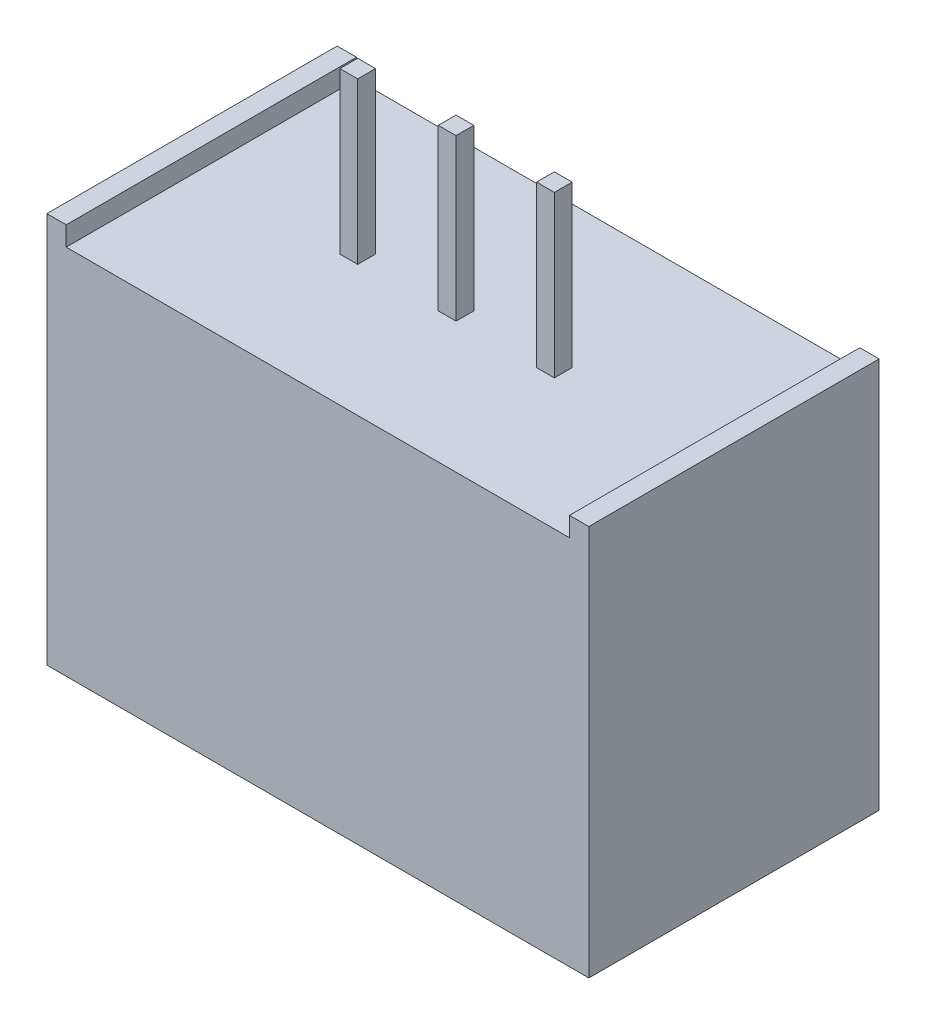
from build123d import *

# Parameters (mm, degrees)
BOTTOM_VIEW_W       = 14
BOTTOM_VIEW_H       = 7.5
BOSS_EXTRUDE1_DEPTH = 10.1
BOTTOM_VIEW_3_W     = 0.46
BOTTOM_VIEW_3_H     = 0.46
BOTTOM_VIEW_3_W_2   = 0.044871794
BOTTOM_VIEW_3_H_2   = 0.365384615
CUT_EXTRUDE1_DEPTH  = 0.5
BOSS_EXTRUDE2_START = -0.5
BOTTOM_VIEW_4_W     = 0.46
BOTTOM_VIEW_4_H     = 0.46
BOSS_EXTRUDE2_DEPTH = 4.15


with BuildPart() as part:
    # Bottom View → Boss-Extrude1 (new body)
    with BuildSketch(Plane(origin=(0, 0, 0), x_dir=(1, 0, 0), z_dir=(0, 1, 0))):
        with Locations((2.58, 0.14)):
            Rectangle(BOTTOM_VIEW_W, BOTTOM_VIEW_H)
    extrude(amount=-BOSS_EXTRUDE1_DEPTH)

    # Bottom View<3> → Cut-Extrude1 (cut)
    # profile 1 of 24: a face of its own
    with BuildSketch(Plane(origin=(0, 0, 0), x_dir=(1, 0, 0), z_dir=(0, 1, 0))):
        with BuildLine():
            Line((9.08, 3.89), (-3.92, 3.89))
            Line((-3.92, 3.89), (-3.92, -3.61))
            Line((-3.92, -3.61), (0.519102564, -3.61))
            Line((0.519102564, -3.61), (0.519102564, -3.11))
            Line((0.519102564, -3.11), (0.616658654, -3.11))
            add(Edge.make_bspline(
                [(0.616658654, -3.11), (0.621434151, -3.110025107), (0.630690252, -3.110073771), (0.644150172, -3.110828504), (0.656757145, -3.1118576), (0.668514827, -3.11349047), (0.679417785, -3.115460724), (0.689498876, -3.117846698), (0.698726043, -3.120707643), (0.709742148, -3.125257111), (0.722302243, -3.132017564), (0.735902013, -3.142007359), (0.74753119, -3.154226282), (0.757557807, -3.168009519), (0.765529395, -3.183171772), (0.771296438, -3.199351656), (0.774947563, -3.216340476), (0.775323054, -3.228003788), (0.775512821, -3.233898237)],
                knots=[0, 0, 0, 0, 1.001505555, 1.941167018, 2.826882275, 3.653841531, 4.429895133, 5.150066043, 5.825578002, 6.45369114, 7.647487171, 8.808567382, 9.977351308, 11.170798116, 12.373658725, 13.556498008, 14.765093433, 16, 16, 16, 16], degree=3))
            add(Edge.make_bspline(
                [(0.775512821, -3.233898237), (0.775356646, -3.239420031), (0.77504975, -3.250270876), (0.77211507, -3.266141463), (0.767520689, -3.28124878), (0.761134224, -3.295537692), (0.752833939, -3.308685351), (0.742997037, -3.320797818), (0.731128922, -3.331362255), (0.722237031, -3.337268384), (0.717720353, -3.340268429)],
                knots=[0, 0, 0, 0, 1.044552857, 2.05264487, 3.044412934, 4.028983338, 5.005914585, 5.980388656, 6.974128949, 8, 8, 8, 8], degree=3))
            add(Edge.make_bspline(
                [(0.717720353, -3.340268429), (0.723400414, -3.342449144), (0.734267778, -3.34662139), (0.749222922, -3.353997885), (0.7621079, -3.362021043), (0.773021778, -3.370782736), (0.782355729, -3.380226852), (0.790506149, -3.390491868), (0.797460631, -3.401711691), (0.80341962, -3.413769339), (0.808069442, -3.426541692), (0.811551714, -3.439908945), (0.813547064, -3.453823167), (0.813831013, -3.463292507), (0.813974359, -3.468072917)],
                knots=[0, 0, 0, 0, 1.27268992, 2.434971085, 3.483601985, 4.442670788, 5.356604649, 6.2567628, 7.179492994, 8.113709626, 9.066344395, 10.018646069, 10.999752585, 12, 12, 12, 12], degree=3))
            add(Edge.make_bspline(
                [(0.813974359, -3.468072917), (0.81383481, -3.472953898), (0.813560242, -3.482557367), (0.811534532, -3.496665243), (0.808104659, -3.510147378), (0.80338021, -3.523090976), (0.797214165, -3.535470995), (0.78971017, -3.547301461), (0.780762804, -3.558463509), (0.770753823, -3.569081169), (0.759430659, -3.578627996), (0.747214123, -3.58713024), (0.733950363, -3.594122534), (0.719857221, -3.599996252), (0.704776604, -3.604482994), (0.688776231, -3.607621933), (0.671869903, -3.609736939), (0.66026851, -3.609910825), (0.65431891, -3.61)],
                knots=[0, 0, 0, 0, 0.978564426, 1.925352924, 2.850884081, 3.763762016, 4.682927383, 5.618979971, 6.567305752, 7.547517671, 8.540179244, 9.531824382, 10.526200242, 11.540722885, 12.589160233, 13.674978461, 14.80764778, 16, 16, 16, 16], degree=3))
            Line((0.65431891, -3.61), (1.027303466, -3.61))
            add(Edge.make_bspline(
                [(1.027303466, -3.61), (1.025496749, -3.6095279), (1.017723578, -3.607365575), (1.004318924, -3.602593724), (0.987583945, -3.594694503), (0.97190016, -3.584892833), (0.957157315, -3.57338424), (0.943575603, -3.560221963), (0.931290088, -3.545934826), (0.920451087, -3.530913392), (0.911323897, -3.515283379), (0.903844154, -3.499014424), (0.898011038, -3.482177462), (0.893935167, -3.46472106), (0.891314651, -3.446718294), (0.891037627, -3.434495017), (0.890897436, -3.428309295)],
                knots=[2.872016618, 2.872016618, 2.872016618, 2.872016618, 3.173186993, 4.173200201, 5.163417411, 6.152872554, 7.150605724, 8.17532212, 9.198891216, 10.186952605, 11.159729845, 12.11414092, 13.071450619, 14.029093627, 15.002601286, 16, 16, 16, 16], degree=3))
            add(Edge.make_bspline(
                [(0.890897436, -3.428309295), (0.891057909, -3.422192645), (0.891375618, -3.410082731), (0.893707119, -3.392236008), (0.897615484, -3.374993524), (0.903148541, -3.358432741), (0.910222139, -3.342467679), (0.918845181, -3.327124132), (0.929100985, -3.312411589), (0.936986978, -3.303308435), (0.940977564, -3.298701923)],
                knots=[0, 0, 0, 0, 1.031353054, 2.041901799, 3.029428768, 4.008703097, 4.981709435, 5.96992636, 6.972712378, 8, 8, 8, 8], degree=3))
            add(Edge.make_bspline(
                [(0.940977564, -3.298701923), (0.945613077, -3.29384836), (0.954729629, -3.284302975), (0.970065162, -3.272084043), (0.986135707, -3.261524604), (1.003239268, -3.253028002), (1.021193962, -3.246336785), (1.040082426, -3.241684569), (1.059836071, -3.238648375), (1.073344588, -3.23835435), (1.080200321, -3.238205128)],
                knots=[0, 0, 0, 0, 1.027980169, 2.021703884, 2.998553061, 3.971491411, 4.943284454, 5.930300938, 6.949603206, 8, 8, 8, 8], degree=3))
            add(Edge.make_bspline(
                [(1.080200321, -3.238205128), (1.087056217, -3.238351113), (1.100498953, -3.238637352), (1.120185794, -3.241696633), (1.138977957, -3.246374828), (1.156947413, -3.252842194), (1.173864026, -3.261511044), (1.189974204, -3.271855229), (1.205233777, -3.284109885), (1.214379924, -3.293589609), (1.219022436, -3.298401442)],
                knots=[0, 0, 0, 0, 1.054011418, 2.066658804, 3.057071809, 4.030435133, 4.997543892, 5.974964718, 6.972108034, 8, 8, 8, 8], degree=3))
            add(Edge.make_bspline(
                [(1.219022436, -3.298401442), (1.223019858, -3.30300344), (1.230937341, -3.312118375), (1.241089586, -3.326897748), (1.249835524, -3.342203477), (1.256844518, -3.358238809), (1.26237095, -3.374863762), (1.266294621, -3.392135478), (1.268628469, -3.410015813), (1.268943178, -3.422159219), (1.269102564, -3.428309295)],
                knots=[0, 0, 0, 0, 1.025258237, 2.030674902, 3.01204498, 3.988269485, 4.97094183, 5.956517959, 6.965070386, 8, 8, 8, 8], degree=3))
            add(Edge.make_bspline(
                [(1.269102564, -3.428309295), (1.268962373, -3.434495017), (1.268685349, -3.446718294), (1.266064832, -3.46472106), (1.261988963, -3.482177463), (1.256155843, -3.49901442), (1.248676113, -3.515283395), (1.239548872, -3.530913331), (1.22871007, -3.545935064), (1.216423785, -3.560221041), (1.202844945, -3.573387643), (1.188114067, -3.58486311), (1.172520633, -3.594694756), (1.155857297, -3.602614244), (1.142475168, -3.607367156), (1.134699566, -3.60952777), (1.13289094, -3.61)],
                knots=[0, 0, 0, 0, 0.998656419, 1.973391657, 2.932242238, 3.890759089, 4.846373663, 5.82037756, 6.809684879, 7.83454468, 8.860553229, 9.859544525, 10.845671541, 11.83227036, 12.833544569, 13.135400297, 13.135400297, 13.135400297, 13.135400297], degree=3))
            Line((1.13289094, -3.61), (1.403717949, -3.61))
            Line((1.403717949, -3.61), (1.403717949, -3.289487179))
            Line((1.403717949, -3.289487179), (1.339615385, -3.289487179))
            Line((1.339615385, -3.289487179), (1.339615385, -3.244615385))
            Line((1.339615385, -3.244615385), (1.403717949, -3.244615385))
            Line((1.403717949, -3.244615385), (1.403717949, -3.097179487))
            Line((1.403717949, -3.097179487), (1.448589744, -3.097179487))
            Line((1.448589744, -3.097179487), (1.448589744, -3.244615385))
            Line((1.448589744, -3.244615385), (1.512692308, -3.244615385))
            Line((1.512692308, -3.244615385), (1.512692308, -3.289487179))
            Line((1.512692308, -3.289487179), (1.448589744, -3.289487179))
            Line((1.448589744, -3.289487179), (1.448589744, -3.61))
            Line((1.448589744, -3.61), (1.634487179, -3.61))
            Line((1.634487179, -3.61), (1.634487179, -3.289487179))
            Line((1.634487179, -3.289487179), (1.570384615, -3.289487179))
            Line((1.570384615, -3.289487179), (1.570384615, -3.244615385))
            Line((1.570384615, -3.244615385), (1.634487179, -3.244615385))
            Line((1.634487179, -3.244615385), (1.634487179, -3.097179487))
            Line((1.634487179, -3.097179487), (1.679358974, -3.097179487))
            Line((1.679358974, -3.097179487), (1.679358974, -3.244615385))
            Line((1.679358974, -3.244615385), (1.743461538, -3.244615385))
            Line((1.743461538, -3.244615385), (1.743461538, -3.289487179))
            Line((1.743461538, -3.289487179), (1.679358974, -3.289487179))
            Line((1.679358974, -3.289487179), (1.679358974, -3.61))
            Line((1.679358974, -3.61), (1.943970133, -3.61))
            add(Edge.make_bspline(
                [(1.943970133, -3.61), (1.942163415, -3.6095279), (1.934390245, -3.607365575), (1.92098559, -3.602593724), (1.904250612, -3.594694503), (1.888566827, -3.584892833), (1.873823982, -3.57338424), (1.86024227, -3.560221963), (1.847956755, -3.545934826), (1.837117753, -3.530913392), (1.827990564, -3.515283379), (1.820510821, -3.499014424), (1.814677704, -3.482177462), (1.810601834, -3.46472106), (1.807981318, -3.446718294), (1.807704294, -3.434495017), (1.807564103, -3.428309295)],
                knots=[2.872016618, 2.872016618, 2.872016618, 2.872016618, 3.173186993, 4.173200201, 5.163417411, 6.152872554, 7.150605724, 8.17532212, 9.198891216, 10.186952605, 11.159729845, 12.11414092, 13.071450619, 14.029093627, 15.002601286, 16, 16, 16, 16], degree=3))
            add(Edge.make_bspline(
                [(1.807564103, -3.428309295), (1.807724575, -3.422192645), (1.808042284, -3.410082731), (1.810373786, -3.392236008), (1.814282151, -3.374993524), (1.819815207, -3.358432741), (1.826888806, -3.342467679), (1.835511847, -3.327124132), (1.845767652, -3.312411589), (1.853653645, -3.303308435), (1.857644231, -3.298701923)],
                knots=[0, 0, 0, 0, 1.031353054, 2.041901799, 3.029428768, 4.008703097, 4.981709435, 5.96992636, 6.972712378, 8, 8, 8, 8], degree=3))
            add(Edge.make_bspline(
                [(1.857644231, -3.298701923), (1.862279744, -3.29384836), (1.871396296, -3.284302975), (1.886731828, -3.272084043), (1.902802374, -3.261524604), (1.919905935, -3.253028002), (1.937860629, -3.246336785), (1.956749092, -3.241684569), (1.976502737, -3.238648375), (1.990011255, -3.23835435), (1.996866987, -3.238205128)],
                knots=[0, 0, 0, 0, 1.027980169, 2.021703884, 2.998553061, 3.971491411, 4.943284454, 5.930300938, 6.949603206, 8, 8, 8, 8], degree=3))
            add(Edge.make_bspline(
                [(1.996866987, -3.238205128), (2.003722883, -3.238351113), (2.01716562, -3.238637352), (2.036852461, -3.241696633), (2.055644623, -3.246374828), (2.073614079, -3.252842194), (2.090530693, -3.261511044), (2.106640871, -3.271855229), (2.121900443, -3.284109885), (2.13104659, -3.293589609), (2.135689103, -3.298401442)],
                knots=[0, 0, 0, 0, 1.054011418, 2.066658804, 3.057071809, 4.030435133, 4.997543892, 5.974964718, 6.972108034, 8, 8, 8, 8], degree=3))
            add(Edge.make_bspline(
                [(2.135689103, -3.298401442), (2.139686525, -3.30300344), (2.147604007, -3.312118375), (2.157756253, -3.326897748), (2.16650219, -3.342203477), (2.173511185, -3.358238809), (2.179037617, -3.374863762), (2.182961287, -3.392135478), (2.185295135, -3.410015813), (2.185609845, -3.422159219), (2.185769231, -3.428309295)],
                knots=[0, 0, 0, 0, 1.025258237, 2.030674902, 3.01204498, 3.988269485, 4.97094183, 5.956517959, 6.965070386, 8, 8, 8, 8], degree=3))
            add(Edge.make_bspline(
                [(2.185769231, -3.428309295), (2.18562904, -3.434495017), (2.185352016, -3.446718294), (2.182731499, -3.46472106), (2.17865563, -3.482177463), (2.17282251, -3.49901442), (2.16534278, -3.515283395), (2.156215539, -3.530913331), (2.145376736, -3.545935064), (2.133090451, -3.560221041), (2.119511612, -3.573387643), (2.104780733, -3.58486311), (2.0891873, -3.594694756), (2.072523964, -3.602614244), (2.059141834, -3.607367156), (2.051366232, -3.60952777), (2.049557607, -3.61)],
                knots=[0, 0, 0, 0, 0.998656419, 1.973391657, 2.932242238, 3.890759089, 4.846373663, 5.82037756, 6.809684879, 7.83454468, 8.860553229, 9.859544525, 10.845671541, 11.83227036, 12.833544569, 13.135400297, 13.135400297, 13.135400297, 13.135400297], degree=3))
            Line((2.049557607, -3.61), (2.275512821, -3.61))
            Line((2.275512821, -3.61), (2.275512821, -3.244615385))
            Line((2.275512821, -3.244615385), (2.320384615, -3.244615385))
            Line((2.320384615, -3.244615385), (2.320384615, -3.308116987))
            add(Edge.make_bspline(
                [(2.320384615, -3.308116987), (2.32442518, -3.302561616), (2.332167288, -3.291916991), (2.344862381, -3.277889807), (2.357544683, -3.265985785), (2.366678023, -3.259736804), (2.371065705, -3.256734776)],
                knots=[0, 0, 0, 0, 1.134379233, 2.173579362, 3.122582517, 4, 4, 4, 4], degree=3))
            add(Edge.make_bspline(
                [(2.371065705, -3.256734776), (2.377046371, -3.253876866), (2.388903214, -3.248210979), (2.407677389, -3.242463327), (2.426888056, -3.23893117), (2.439860658, -3.238448117), (2.446386218, -3.238205128)],
                knots=[0, 0, 0, 0, 1.014936303, 2.012140481, 3.000054389, 4, 4, 4, 4], degree=3))
            add(Edge.make_bspline(
                [(2.446386218, -3.238205128), (2.450799503, -3.238354455), (2.459533157, -3.238649966), (2.472473742, -3.240572828), (2.485024972, -3.243896567), (2.49711269, -3.248526185), (2.508501359, -3.254132855), (2.518942673, -3.260711384), (2.52831756, -3.268096681), (2.536621281, -3.276622243), (2.544088285, -3.286527471), (2.550956692, -3.298079506), (2.55730315, -3.311537744), (2.56082048, -3.321304392), (2.562672276, -3.326446314)],
                knots=[0, 0, 0, 0, 1.009824226, 1.998387844, 2.986035974, 3.974953746, 4.955485308, 5.885931332, 6.793869504, 7.679848016, 8.601185859, 9.625726857, 10.749998409, 12, 12, 12, 12], degree=3))
            add(Edge.make_bspline(
                [(2.562672276, -3.326446314), (2.564631026, -3.322914254), (2.568485571, -3.315963656), (2.574957805, -3.306126762), (2.581738919, -3.296925791), (2.588886704, -3.288353445), (2.59637593, -3.280452055), (2.604241845, -3.273195498), (2.61243967, -3.26655261), (2.623838562, -3.258792159), (2.638668934, -3.250549133), (2.657367236, -3.243402212), (2.676817261, -3.238985622), (2.690019789, -3.238467012), (2.696686699, -3.238205128)],
                knots=[0, 0, 0, 0, 0.86119277, 1.694706429, 2.50939023, 3.298075842, 4.073795165, 4.829715201, 5.57930267, 6.321991688, 7.768977793, 9.186738141, 10.579381044, 12, 12, 12, 12], degree=3))
            add(Edge.make_bspline(
                [(2.696686699, -3.238205128), (2.702812622, -3.23843616), (2.714801649, -3.238888311), (2.732255544, -3.242438807), (2.748532944, -3.248535614), (2.763601098, -3.256854705), (2.777195357, -3.267308874), (2.789011973, -3.279747279), (2.798979168, -3.29408194), (2.805490402, -3.307566509), (2.809906868, -3.319471557), (2.812629902, -3.329615313), (2.815035572, -3.34077982), (2.817032893, -3.352978429), (2.818492686, -3.36625423), (2.819574217, -3.380585498), (2.820306228, -3.395983372), (2.820357952, -3.406607014), (2.820384615, -3.412083333)],
                knots=[0, 0, 0, 0, 1.209669288, 2.367440248, 3.500751976, 4.631527125, 5.755587489, 6.87532382, 8.007944318, 9.190864318, 9.82315674, 10.514484317, 11.263564316, 12.079023757, 12.955305781, 13.901327259, 14.918167583, 16, 16, 16, 16], degree=3))
            Line((2.820384615, -3.412083333), (2.820384615, -3.61))
            Line((2.820384615, -3.61), (3.301153846, -3.61))
            Line((3.301153846, -3.61), (3.089615385, -3.11))
            Line((3.089615385, -3.11), (3.137692308, -3.11))
            Line((3.137692308, -3.11), (3.304358974, -3.504030449))
            Line((3.304358974, -3.504030449), (3.471025641, -3.11))
            Line((3.471025641, -3.11), (3.519102564, -3.11))
            Line((3.519102564, -3.11), (3.307564103, -3.61))
            Line((3.307564103, -3.61), (3.589615385, -3.61))
            Line((3.589615385, -3.61), (3.589615385, -3.244615385))
            Line((3.589615385, -3.244615385), (3.634487179, -3.244615385))
            Line((3.634487179, -3.244615385), (3.634487179, -3.61))
            Line((3.634487179, -3.61), (3.861046912, -3.61))
            add(Edge.make_bspline(
                [(3.861046912, -3.61), (3.859001551, -3.609468253), (3.850980591, -3.607234069), (3.837415866, -3.602393778), (3.821024116, -3.594189875), (3.805809708, -3.584195663), (3.791692633, -3.572462484), (3.779117746, -3.558888706), (3.767797191, -3.544362712), (3.757807789, -3.529226157), (3.749456727, -3.513517125), (3.742663497, -3.497335622), (3.737177088, -3.480783637), (3.733353273, -3.46371057), (3.731149023, -3.44616263), (3.730811245, -3.434291582), (3.730641026, -3.428309295)],
                knots=[2.931969346, 2.931969346, 2.931969346, 2.931969346, 3.276747158, 4.290159414, 5.277019952, 6.260822364, 7.254936242, 8.264827045, 9.274100331, 10.257902744, 11.220704747, 12.172965371, 13.118907548, 14.062713208, 15.023725156, 16, 16, 16, 16], degree=3))
            add(Edge.make_bspline(
                [(3.730641026, -3.428309295), (3.730792332, -3.422695748), (3.7310922, -3.411570438), (3.732982312, -3.395103932), (3.736332069, -3.379099867), (3.740928686, -3.363544946), (3.746864579, -3.348465213), (3.754126324, -3.333851489), (3.762725235, -3.319719327), (3.769364189, -3.310804593), (3.772708333, -3.306314103)],
                knots=[0, 0, 0, 0, 1.024358464, 2.0301432, 3.019427413, 4.004406732, 4.986367066, 5.972626655, 6.978780325, 8, 8, 8, 8], degree=3))
            add(Edge.make_bspline(
                [(3.772708333, -3.306314103), (3.777238002, -3.300904264), (3.786153852, -3.290255957), (3.801233331, -3.276264767), (3.817561931, -3.264544228), (3.83493502, -3.254828923), (3.853554516, -3.247446973), (3.873170129, -3.24194589), (3.894005213, -3.238863317), (3.908248816, -3.238427912), (3.915536859, -3.238205128)],
                knots=[0, 0, 0, 0, 1.030682036, 2.02871468, 2.997146059, 3.962720338, 4.930598197, 5.918074684, 6.934738563, 8, 8, 8, 8], degree=3))
            add(Edge.make_bspline(
                [(3.915536859, -3.238205128), (3.923029374, -3.238398564), (3.937727981, -3.23877804), (3.959161141, -3.242296088), (3.979441243, -3.247875024), (3.998560172, -3.255754137), (4.016519867, -3.265919787), (4.033203588, -3.278511479), (4.048896661, -3.293142634), (4.058026458, -3.304394521), (4.062672276, -3.310120192)],
                knots=[0, 0, 0, 0, 1.056321875, 2.072262726, 3.055038591, 4.01806755, 4.982017516, 5.957941055, 6.960871419, 8, 8, 8, 8], degree=3))
            add(Edge.make_bspline(
                [(4.062672276, -3.310120192), (4.065833267, -3.31443499), (4.072134209, -3.323035864), (4.080026652, -3.337060315), (4.086877708, -3.351733257), (4.092353845, -3.367291871), (4.09678806, -3.383551811), (4.099996177, -3.400629317), (4.101877551, -3.418519304), (4.102247365, -3.430708812), (4.102435897, -3.436923077)],
                knots=[0, 0, 0, 0, 0.94817472, 1.890038105, 2.849395472, 3.817997239, 4.812318967, 5.836947057, 6.897266129, 8, 8, 8, 8], degree=3))
            Line((4.102435897, -3.436923077), (3.775512821, -3.436923077))
            add(Edge.make_bspline(
                [(3.775512821, -3.436923077), (3.775732764, -3.441737429), (3.776165275, -3.451204658), (3.778181724, -3.465057627), (3.78136012, -3.478253819), (3.785827129, -3.490694253), (3.791236678, -3.502541414), (3.797863209, -3.51370742), (3.80576886, -3.52414141), (3.814586817, -3.533936715), (3.824402116, -3.542659681), (3.834728223, -3.550467078), (3.845713018, -3.557010734), (3.857269887, -3.562322147), (3.869380142, -3.566480192), (3.882047599, -3.569318452), (3.89524733, -3.571219468), (3.904245292, -3.571430848), (3.908826122, -3.571538462)],
                knots=[0, 0, 0, 0, 1.094153842, 2.151609401, 3.174256925, 4.172055639, 5.149267565, 6.128595816, 7.11444997, 8.118368179, 9.117203808, 10.09244225, 11.054858984, 12.015122123, 12.976791628, 13.957293641, 14.960065497, 16, 16, 16, 16], degree=3))
            add(Edge.make_bspline(
                [(3.908826122, -3.571538462), (3.913304857, -3.571451596), (3.922191527, -3.571279239), (3.935425935, -3.569603252), (3.948445868, -3.566893212), (3.961197437, -3.563194642), (3.973421844, -3.558683663), (3.984742636, -3.553240398), (3.995154096, -3.547219006), (4.004885091, -3.540331909), (4.014323804, -3.531902168), (4.023687017, -3.52138278), (4.033726539, -3.508941704), (4.040010766, -3.499578038), (4.043341346, -3.494615385)],
                knots=[0, 0, 0, 0, 0.99110716, 1.966546729, 2.947904876, 3.932708344, 4.903319531, 5.828989031, 6.710028674, 7.56322171, 8.463672341, 9.504779593, 10.677557249, 12, 12, 12, 12], degree=3))
            Line((4.043341346, -3.494615385), (4.083205128, -3.515548878))
            add(Edge.make_bspline(
                [(4.083205128, -3.515548878), (4.080028472, -3.52118364), (4.073847956, -3.532146655), (4.063219278, -3.547208349), (4.052077553, -3.560758023), (4.039919844, -3.572433687), (4.027109889, -3.582612457), (4.013576653, -3.59151786), (3.999249679, -3.59910622), (3.984252042, -3.605447117), (3.973861677, -3.608645036), (3.968611116, -3.61)],
                knots=[0, 0, 0, 0, 1.120438281, 2.179929193, 3.190490725, 4.156257408, 5.095198341, 6.022838206, 6.959905092, 7.901321166, 8.84081453, 8.84081453, 8.84081453, 8.84081453], degree=3))
            Line((3.968611116, -3.61), (4.292239583, -3.61))
            Line((4.292239583, -3.61), (4.140897436, -3.244615385))
            Line((4.140897436, -3.244615385), (4.189074519, -3.244615385))
            Line((4.189074519, -3.244615385), (4.297948718, -3.507435897))
            Line((4.297948718, -3.507435897), (4.417239583, -3.244615385))
            Line((4.417239583, -3.244615385), (4.424851763, -3.244615385))
            Line((4.424851763, -3.244615385), (4.541538462, -3.507435897))
            Line((4.541538462, -3.507435897), (4.651414263, -3.244615385))
            Line((4.651414263, -3.244615385), (4.698589744, -3.244615385))
            Line((4.698589744, -3.244615385), (4.545845353, -3.61))
            Line((4.545845353, -3.61), (9.08, -3.61))
            Line((9.08, -3.61), (9.08, 3.89))
        make_face()
        Rectangle(BOTTOM_VIEW_3_W, BOTTOM_VIEW_3_H, mode=Mode.SUBTRACT)
        with Locations((2.54, 0)):
            Rectangle(BOTTOM_VIEW_3_W, BOTTOM_VIEW_3_H, mode=Mode.SUBTRACT)
        with BuildLine():
            add(Edge.make_bspline(
                [(3.570384615, -3.12943109), (3.570536199, -3.126840968), (3.570833919, -3.121753807), (3.573287079, -3.114454516), (3.577124194, -3.107742873), (3.58247856, -3.101882087), (3.588854769, -3.096989882), (3.595974304, -3.093359742), (3.60374069, -3.091135265), (3.609098329, -3.090893463), (3.611850962, -3.090769231)],
                knots=[0, 0, 0, 0, 0.98631895, 1.937192651, 2.907499808, 3.917963147, 4.944918757, 5.95915025, 6.951458133, 8, 8, 8, 8], degree=3))
            add(Edge.make_bspline(
                [(3.611850962, -3.090769231), (3.614635435, -3.090898395), (3.620087969, -3.091151325), (3.627972722, -3.09331725), (3.635152295, -3.096988633), (3.641520543, -3.101914302), (3.646985098, -3.10770708), (3.650810914, -3.114458647), (3.653269827, -3.121752738), (3.653566764, -3.126840608), (3.653717949, -3.12943109)],
                knots=[0, 0, 0, 0, 1.055194115, 2.066272739, 3.074728998, 4.095836921, 5.109056067, 6.073838105, 7.019297344, 8, 8, 8, 8], degree=3))
            add(Edge.make_bspline(
                [(3.653717949, -3.12943109), (3.653563354, -3.131954326), (3.65325774, -3.136942465), (3.650812813, -3.144110104), (3.646952493, -3.150767859), (3.641524047, -3.156549389), (3.635151367, -3.161472335), (3.627972969, -3.16514444), (3.620087905, -3.167310174), (3.614635413, -3.16756313), (3.611850962, -3.167692308)],
                knots=[0, 0, 0, 0, 0.96129708, 1.900370562, 2.859976407, 3.87933698, 4.906634145, 5.921202961, 6.938410037, 8, 8, 8, 8], degree=3))
            add(Edge.make_bspline(
                [(3.611850962, -3.167692308), (3.609098351, -3.167568062), (3.603740754, -3.167326234), (3.595974062, -3.165101946), (3.588855706, -3.161471078), (3.582475039, -3.156581623), (3.57715644, -3.150732352), (3.57328525, -3.144114167), (3.57084597, -3.136941431), (3.570539595, -3.131953978), (3.570384615, -3.12943109)],
                knots=[0, 0, 0, 0, 1.054934014, 2.053291228, 3.073705704, 4.106921865, 5.123545215, 6.088680038, 7.033164197, 8, 8, 8, 8], degree=3))
        make_face(mode=Mode.SUBTRACT)
        with Locations((5.08, 0)):
            Rectangle(BOTTOM_VIEW_3_W, BOTTOM_VIEW_3_H, mode=Mode.SUBTRACT)
        Polygon((-0.806923077, 0.667435897), (-0.748229167, 0.77), (-0.563333333, 0.77), (-0.563333333, -0.23), (-0.653076923, -0.23), (-0.653076923, 0.667435897), align=None, mode=Mode.SUBTRACT)
    # profile 2 of 24: a face of its own
    with BuildSketch(Plane(origin=(0, 0, 0), x_dir=(1, 0, 0), z_dir=(0, 1, 0))):
        with BuildLine():
            Line((0.519102564, -3.11), (0.519102564, -3.61))
            Line((0.519102564, -3.61), (0.65431891, -3.61))
            add(Edge.make_bspline(
                [(0.813974359, -3.468072917), (0.81383481, -3.472953898), (0.813560242, -3.482557367), (0.811534532, -3.496665243), (0.808104659, -3.510147378), (0.80338021, -3.523090976), (0.797214165, -3.535470995), (0.78971017, -3.547301461), (0.780762804, -3.558463509), (0.770753823, -3.569081169), (0.759430659, -3.578627996), (0.747214123, -3.58713024), (0.733950363, -3.594122534), (0.719857221, -3.599996252), (0.704776604, -3.604482994), (0.688776231, -3.607621933), (0.671869903, -3.609736939), (0.66026851, -3.609910825), (0.65431891, -3.61)],
                knots=[0, 0, 0, 0, 0.978564426, 1.925352924, 2.850884081, 3.763762016, 4.682927383, 5.618979971, 6.567305752, 7.547517671, 8.540179244, 9.531824382, 10.526200242, 11.540722885, 12.589160233, 13.674978461, 14.80764778, 16, 16, 16, 16], degree=3))
            add(Edge.make_bspline(
                [(0.717720353, -3.340268429), (0.723400414, -3.342449144), (0.734267778, -3.34662139), (0.749222922, -3.353997885), (0.7621079, -3.362021043), (0.773021778, -3.370782736), (0.782355729, -3.380226852), (0.790506149, -3.390491868), (0.797460631, -3.401711691), (0.80341962, -3.413769339), (0.808069442, -3.426541692), (0.811551714, -3.439908945), (0.813547064, -3.453823167), (0.813831013, -3.463292507), (0.813974359, -3.468072917)],
                knots=[0, 0, 0, 0, 1.27268992, 2.434971085, 3.483601985, 4.442670788, 5.356604649, 6.2567628, 7.179492994, 8.113709626, 9.066344395, 10.018646069, 10.999752585, 12, 12, 12, 12], degree=3))
            add(Edge.make_bspline(
                [(0.775512821, -3.233898237), (0.775356646, -3.239420031), (0.77504975, -3.250270876), (0.77211507, -3.266141463), (0.767520689, -3.28124878), (0.761134224, -3.295537692), (0.752833939, -3.308685351), (0.742997037, -3.320797818), (0.731128922, -3.331362255), (0.722237031, -3.337268384), (0.717720353, -3.340268429)],
                knots=[0, 0, 0, 0, 1.044552857, 2.05264487, 3.044412934, 4.028983338, 5.005914585, 5.980388656, 6.974128949, 8, 8, 8, 8], degree=3))
            add(Edge.make_bspline(
                [(0.616658654, -3.11), (0.621434151, -3.110025107), (0.630690252, -3.110073771), (0.644150172, -3.110828504), (0.656757145, -3.1118576), (0.668514827, -3.11349047), (0.679417785, -3.115460724), (0.689498876, -3.117846698), (0.698726043, -3.120707643), (0.709742148, -3.125257111), (0.722302243, -3.132017564), (0.735902013, -3.142007359), (0.74753119, -3.154226282), (0.757557807, -3.168009519), (0.765529395, -3.183171772), (0.771296438, -3.199351656), (0.774947563, -3.216340476), (0.775323054, -3.228003788), (0.775512821, -3.233898237)],
                knots=[0, 0, 0, 0, 1.001505555, 1.941167018, 2.826882275, 3.653841531, 4.429895133, 5.150066043, 5.825578002, 6.45369114, 7.647487171, 8.808567382, 9.977351308, 11.170798116, 12.373658725, 13.556498008, 14.765093433, 16, 16, 16, 16], degree=3))
            Line((0.616658654, -3.11), (0.519102564, -3.11))
        make_face()
        with BuildLine():
            Line((0.563974359, -3.558717949), (0.563974359, -3.372820513))
            Line((0.563974359, -3.372820513), (0.593721955, -3.372820513))
            add(Edge.make_bspline(
                [(0.687271635, -3.378729968), (0.684838907, -3.378236385), (0.679564251, -3.377166194), (0.670963168, -3.376036522), (0.661143758, -3.375030085), (0.650083347, -3.374285634), (0.637767941, -3.373516128), (0.624171238, -3.373216867), (0.609348765, -3.37285983), (0.59906414, -3.372833954), (0.593721955, -3.372820513)],
                knots=[0, 0, 0, 0, 0.634451884, 1.375622551, 2.216452059, 3.157844607, 4.20941857, 5.370758133, 6.634282058, 8, 8, 8, 8], degree=3))
            add(Edge.make_bspline(
                [(0.769102564, -3.468072917), (0.769063121, -3.465431011), (0.76898487, -3.460189813), (0.767804782, -3.452487554), (0.766088515, -3.445026715), (0.763869739, -3.437787037), (0.760638386, -3.430899412), (0.756866023, -3.424227618), (0.752442965, -3.417762835), (0.745550942, -3.409589656), (0.735526372, -3.40017294), (0.721282547, -3.390953297), (0.705086505, -3.383517896), (0.69333972, -3.380360828), (0.687271635, -3.378729968)],
                knots=[0, 0, 0, 0, 0.723448775, 1.435228256, 2.130040452, 2.821711965, 3.505591119, 4.210454504, 4.921174351, 5.648778258, 7.137944449, 8.670945889, 10.280296675, 12, 12, 12, 12], degree=3))
            add(Edge.make_bspline(
                [(0.627876603, -3.558717949), (0.632450735, -3.558663128), (0.641266772, -3.558557467), (0.653995519, -3.558212531), (0.665793105, -3.55742792), (0.676605696, -3.556192799), (0.686550046, -3.55485302), (0.695506861, -3.553051409), (0.703548746, -3.550987272), (0.712873647, -3.547796675), (0.723374148, -3.542840037), (0.734689985, -3.535366576), (0.744750873, -3.526463246), (0.753294482, -3.51615883), (0.760296337, -3.504954355), (0.765389974, -3.493076447), (0.768531524, -3.480721372), (0.768911834, -3.472297556), (0.769102564, -3.468072917)],
                knots=[0, 0, 0, 0, 1.160039823, 2.235823828, 3.228722157, 4.157150951, 4.99529583, 5.772374946, 6.472645482, 7.099169577, 8.269452708, 9.405989375, 10.527446681, 11.663510218, 12.788923519, 13.866172445, 14.929861265, 16, 16, 16, 16], degree=3))
            Line((0.627876603, -3.558717949), (0.563974359, -3.558717949))
        make_face(mode=Mode.SUBTRACT)
        with BuildLine():
            Line((0.563974359, -3.321538462), (0.563974359, -3.161282051))
            Line((0.563974359, -3.161282051), (0.624871795, -3.161282051))
            add(Edge.make_bspline(
                [(0.730641026, -3.234799679), (0.730565857, -3.232024569), (0.730418406, -3.226580888), (0.729210791, -3.218645266), (0.72715828, -3.211181872), (0.724521953, -3.204088428), (0.720837854, -3.197586735), (0.716500217, -3.191451993), (0.711259404, -3.185893119), (0.705294073, -3.180697476), (0.698435699, -3.176091115), (0.690688371, -3.17205672), (0.681947275, -3.168808038), (0.672359724, -3.165962873), (0.66177814, -3.163964546), (0.650324632, -3.162299776), (0.637905387, -3.161452241), (0.629313229, -3.161340047), (0.624871795, -3.161282051)],
                knots=[0, 0, 0, 0, 0.91205012, 1.789085906, 2.630437955, 3.453916878, 4.269457761, 5.079663411, 5.91843418, 6.774407191, 7.675494373, 8.627863946, 9.638891023, 10.736472738, 11.911756761, 13.175263542, 14.539845004, 16, 16, 16, 16], degree=3))
            add(Edge.make_bspline(
                [(0.594122596, -3.321538462), (0.598529567, -3.32148133), (0.607044733, -3.321370939), (0.619376146, -3.321054723), (0.630822577, -3.320169288), (0.641364268, -3.319284107), (0.650984617, -3.317844881), (0.659662312, -3.31613172), (0.66753354, -3.314319877), (0.676610618, -3.311238521), (0.686906753, -3.306684568), (0.697882911, -3.299617163), (0.707559264, -3.291199398), (0.71573029, -3.281486403), (0.722417643, -3.270791234), (0.72706246, -3.259284537), (0.730212072, -3.247253089), (0.730496576, -3.238993339), (0.730641026, -3.234799679)],
                knots=[0, 0, 0, 0, 1.156816544, 2.235205308, 3.236616184, 4.169592532, 5.011045266, 5.787822928, 6.49130361, 7.128639758, 8.301311294, 9.436451833, 10.541879658, 11.654887649, 12.756523258, 13.837046038, 14.901820046, 16, 16, 16, 16], degree=3))
            Line((0.594122596, -3.321538462), (0.563974359, -3.321538462))
        make_face(mode=Mode.SUBTRACT)
    # profile 3 of 24: a face of its own
    with BuildSketch(Plane(origin=(0, 0, 0), x_dir=(1, 0, 0), z_dir=(0, 1, 0))):
        Polygon((4.536530449, -3.61), (4.545845353, -3.61), (4.698589744, -3.244615385), (4.651414263, -3.244615385), (4.541538462, -3.507435897), (4.424851763, -3.244615385), (4.417239583, -3.244615385), (4.297948718, -3.507435897), (4.189074519, -3.244615385), (4.140897436, -3.244615385), (4.292239583, -3.61), (4.300552885, -3.61), (4.41974359, -3.347179487), align=None)
    # profile 4 of 24: a face of its own
    with BuildSketch(Plane(origin=(0, 0, 0), x_dir=(1, 0, 0), z_dir=(0, 1, 0))):
        with BuildLine():
            add(Edge.make_bspline(
                [(1.027303466, -3.61), (1.025496749, -3.6095279), (1.017723578, -3.607365575), (1.004318924, -3.602593724), (0.987583945, -3.594694503), (0.97190016, -3.584892833), (0.957157315, -3.57338424), (0.943575603, -3.560221963), (0.931290088, -3.545934826), (0.920451087, -3.530913392), (0.911323897, -3.515283379), (0.903844154, -3.499014424), (0.898011038, -3.482177462), (0.893935167, -3.46472106), (0.891314651, -3.446718294), (0.891037627, -3.434495017), (0.890897436, -3.428309295)],
                knots=[2.872016618, 2.872016618, 2.872016618, 2.872016618, 3.173186993, 4.173200201, 5.163417411, 6.152872554, 7.150605724, 8.17532212, 9.198891216, 10.186952605, 11.159729845, 12.11414092, 13.071450619, 14.029093627, 15.002601286, 16, 16, 16, 16], degree=3))
            Line((1.027303466, -3.61), (1.13289094, -3.61))
            add(Edge.make_bspline(
                [(1.269102564, -3.428309295), (1.268962373, -3.434495017), (1.268685349, -3.446718294), (1.266064832, -3.46472106), (1.261988963, -3.482177463), (1.256155843, -3.49901442), (1.248676113, -3.515283395), (1.239548872, -3.530913331), (1.22871007, -3.545935064), (1.216423785, -3.560221041), (1.202844945, -3.573387643), (1.188114067, -3.58486311), (1.172520633, -3.594694756), (1.155857297, -3.602614244), (1.142475168, -3.607367156), (1.134699566, -3.60952777), (1.13289094, -3.61)],
                knots=[0, 0, 0, 0, 0.998656419, 1.973391657, 2.932242238, 3.890759089, 4.846373663, 5.82037756, 6.809684879, 7.83454468, 8.860553229, 9.859544525, 10.845671541, 11.83227036, 12.833544569, 13.135400297, 13.135400297, 13.135400297, 13.135400297], degree=3))
            add(Edge.make_bspline(
                [(1.219022436, -3.298401442), (1.223019858, -3.30300344), (1.230937341, -3.312118375), (1.241089586, -3.326897748), (1.249835524, -3.342203477), (1.256844518, -3.358238809), (1.26237095, -3.374863762), (1.266294621, -3.392135478), (1.268628469, -3.410015813), (1.268943178, -3.422159219), (1.269102564, -3.428309295)],
                knots=[0, 0, 0, 0, 1.025258237, 2.030674902, 3.01204498, 3.988269485, 4.97094183, 5.956517959, 6.965070386, 8, 8, 8, 8], degree=3))
            add(Edge.make_bspline(
                [(1.080200321, -3.238205128), (1.087056217, -3.238351113), (1.100498953, -3.238637352), (1.120185794, -3.241696633), (1.138977957, -3.246374828), (1.156947413, -3.252842194), (1.173864026, -3.261511044), (1.189974204, -3.271855229), (1.205233777, -3.284109885), (1.214379924, -3.293589609), (1.219022436, -3.298401442)],
                knots=[0, 0, 0, 0, 1.054011418, 2.066658804, 3.057071809, 4.030435133, 4.997543892, 5.974964718, 6.972108034, 8, 8, 8, 8], degree=3))
            add(Edge.make_bspline(
                [(0.940977564, -3.298701923), (0.945613077, -3.29384836), (0.954729629, -3.284302975), (0.970065162, -3.272084043), (0.986135707, -3.261524604), (1.003239268, -3.253028002), (1.021193962, -3.246336785), (1.040082426, -3.241684569), (1.059836071, -3.238648375), (1.073344588, -3.23835435), (1.080200321, -3.238205128)],
                knots=[0, 0, 0, 0, 1.027980169, 2.021703884, 2.998553061, 3.971491411, 4.943284454, 5.930300938, 6.949603206, 8, 8, 8, 8], degree=3))
            add(Edge.make_bspline(
                [(0.890897436, -3.428309295), (0.891057909, -3.422192645), (0.891375618, -3.410082731), (0.893707119, -3.392236008), (0.897615484, -3.374993524), (0.903148541, -3.358432741), (0.910222139, -3.342467679), (0.918845181, -3.327124132), (0.929100985, -3.312411589), (0.936986978, -3.303308435), (0.940977564, -3.298701923)],
                knots=[0, 0, 0, 0, 1.031353054, 2.041901799, 3.029428768, 4.008703097, 4.981709435, 5.96992636, 6.972712378, 8, 8, 8, 8], degree=3))
        make_face()
        with BuildLine():
            add(Edge.make_bspline(
                [(1.08, -3.283076923), (1.07515177, -3.283214722), (1.065580466, -3.283486762), (1.051491954, -3.285555891), (1.037929074, -3.288834106), (1.024866097, -3.293491829), (1.012347072, -3.299505957), (1.000360015, -3.306892866), (0.988869666, -3.315554717), (0.9781008, -3.325477955), (0.968217612, -3.336317812), (0.959577901, -3.347867577), (0.952231458, -3.359939913), (0.946111435, -3.372547371), (0.941553265, -3.385817716), (0.938242834, -3.399600663), (0.936175656, -3.413924294), (0.935906174, -3.423661583), (0.935769231, -3.428609776)],
                knots=[0, 0, 0, 0, 1.021534396, 2.016698045, 2.994645724, 3.958388632, 4.93408049, 5.916473867, 6.921342795, 7.962252576, 8.998418191, 10.008913653, 10.997312074, 11.973003931, 12.956656626, 13.948281152, 14.957379055, 16, 16, 16, 16], degree=3))
            add(Edge.make_bspline(
                [(1.224230769, -3.428609776), (1.224093874, -3.423661553), (1.223824484, -3.413924207), (1.221756632, -3.399600999), (1.218448697, -3.385816485), (1.213881323, -3.372551913), (1.207787893, -3.35990727), (1.20029978, -3.347903023), (1.191695347, -3.336277802), (1.181692902, -3.325512996), (1.170935276, -3.315550848), (1.159440271, -3.306889507), (1.147470988, -3.299538422), (1.134988333, -3.293440387), (1.121923681, -3.288876482), (1.108379805, -3.285536963), (1.094351404, -3.283495506), (1.084814398, -3.283217343), (1.08, -3.283076923)],
                knots=[0, 0, 0, 0, 1.042956736, 2.052379634, 3.044323526, 4.02829302, 5.004299113, 5.996692471, 7.007513377, 8.048758398, 9.090003419, 10.095195979, 11.07790575, 12.047570684, 13.018257071, 13.989683339, 14.985167495, 16, 16, 16, 16], degree=3))
            add(Edge.make_bspline(
                [(1.08, -3.571538462), (1.08646091, -3.571351279), (1.099214566, -3.570981785), (1.117851592, -3.567307668), (1.135696445, -3.561578573), (1.152586643, -3.553589686), (1.168239015, -3.543445056), (1.182431747, -3.531382716), (1.194681548, -3.517180737), (1.205157777, -3.501386804), (1.213664455, -3.484346183), (1.219833484, -3.466376115), (1.223547425, -3.447692966), (1.224001829, -3.435003205), (1.224230769, -3.428609776)],
                knots=[0, 0, 0, 0, 1.02726834, 2.027799167, 3.010890988, 4.004497153, 4.992059811, 5.971914811, 6.958719428, 7.966827853, 8.981595046, 9.981490638, 10.983022906, 12, 12, 12, 12], degree=3))
            add(Edge.make_bspline(
                [(0.935769231, -3.428609776), (0.935998777, -3.435002922), (0.936454383, -3.447692123), (0.940159417, -3.466379426), (0.946357457, -3.484319691), (0.954727068, -3.501407746), (0.965213671, -3.517218072), (0.977568966, -3.531313998), (0.991660352, -3.5434834), (1.007319852, -3.553580663), (1.024227612, -3.561603485), (1.042121372, -3.567289053), (1.060784328, -3.570985009), (1.073538719, -3.571352363), (1.08, -3.571538462)],
                knots=[0, 0, 0, 0, 1.016792936, 2.018143844, 3.017858371, 4.030088057, 5.03801393, 6.028138512, 7.003788237, 7.991172063, 8.984598303, 9.972568034, 10.972917682, 12, 12, 12, 12], degree=3))
        make_face(mode=Mode.SUBTRACT)
    # profile 5 of 24: a face of its own
    with BuildSketch(Plane(origin=(0, 0, 0), x_dir=(1, 0, 0), z_dir=(0, 1, 0))):
        Polygon((4.300552885, -3.61), (4.536530449, -3.61), (4.41974359, -3.347179487), align=None)
    # profile 6 of 24: a face of its own
    with BuildSketch(Plane(origin=(0, 0, 0), x_dir=(1, 0, 0), z_dir=(0, 1, 0))):
        Polygon((1.403717949, -3.289487179), (1.403717949, -3.61), (1.448589744, -3.61), (1.448589744, -3.289487179), (1.512692308, -3.289487179), (1.512692308, -3.244615385), (1.448589744, -3.244615385), (1.448589744, -3.097179487), (1.403717949, -3.097179487), (1.403717949, -3.244615385), (1.339615385, -3.244615385), (1.339615385, -3.289487179), align=None)
    # profile 7 of 24: a face of its own
    with BuildSketch(Plane(origin=(0, 0, 0), x_dir=(1, 0, 0), z_dir=(0, 1, 0))):
        with BuildLine():
            Line((3.861046912, -3.61), (3.968611116, -3.61))
            add(Edge.make_bspline(
                [(4.083205128, -3.515548878), (4.080028472, -3.52118364), (4.073847956, -3.532146655), (4.063219278, -3.547208349), (4.052077553, -3.560758023), (4.039919844, -3.572433687), (4.027109889, -3.582612457), (4.013576653, -3.59151786), (3.999249679, -3.59910622), (3.984252042, -3.605447117), (3.973861677, -3.608645036), (3.968611116, -3.61)],
                knots=[0, 0, 0, 0, 1.120438281, 2.179929193, 3.190490725, 4.156257408, 5.095198341, 6.022838206, 6.959905092, 7.901321166, 8.84081453, 8.84081453, 8.84081453, 8.84081453], degree=3))
            Line((4.083205128, -3.515548878), (4.043341346, -3.494615385))
            add(Edge.make_bspline(
                [(3.908826122, -3.571538462), (3.913304857, -3.571451596), (3.922191527, -3.571279239), (3.935425935, -3.569603252), (3.948445868, -3.566893212), (3.961197437, -3.563194642), (3.973421844, -3.558683663), (3.984742636, -3.553240398), (3.995154096, -3.547219006), (4.004885091, -3.540331909), (4.014323804, -3.531902168), (4.023687017, -3.52138278), (4.033726539, -3.508941704), (4.040010766, -3.499578038), (4.043341346, -3.494615385)],
                knots=[0, 0, 0, 0, 0.99110716, 1.966546729, 2.947904876, 3.932708344, 4.903319531, 5.828989031, 6.710028674, 7.56322171, 8.463672341, 9.504779593, 10.677557249, 12, 12, 12, 12], degree=3))
            add(Edge.make_bspline(
                [(3.775512821, -3.436923077), (3.775732764, -3.441737429), (3.776165275, -3.451204658), (3.778181724, -3.465057627), (3.78136012, -3.478253819), (3.785827129, -3.490694253), (3.791236678, -3.502541414), (3.797863209, -3.51370742), (3.80576886, -3.52414141), (3.814586817, -3.533936715), (3.824402116, -3.542659681), (3.834728223, -3.550467078), (3.845713018, -3.557010734), (3.857269887, -3.562322147), (3.869380142, -3.566480192), (3.882047599, -3.569318452), (3.89524733, -3.571219468), (3.904245292, -3.571430848), (3.908826122, -3.571538462)],
                knots=[0, 0, 0, 0, 1.094153842, 2.151609401, 3.174256925, 4.172055639, 5.149267565, 6.128595816, 7.11444997, 8.118368179, 9.117203808, 10.09244225, 11.054858984, 12.015122123, 12.976791628, 13.957293641, 14.960065497, 16, 16, 16, 16], degree=3))
            Line((3.775512821, -3.436923077), (4.102435897, -3.436923077))
            add(Edge.make_bspline(
                [(4.062672276, -3.310120192), (4.065833267, -3.31443499), (4.072134209, -3.323035864), (4.080026652, -3.337060315), (4.086877708, -3.351733257), (4.092353845, -3.367291871), (4.09678806, -3.383551811), (4.099996177, -3.400629317), (4.101877551, -3.418519304), (4.102247365, -3.430708812), (4.102435897, -3.436923077)],
                knots=[0, 0, 0, 0, 0.94817472, 1.890038105, 2.849395472, 3.817997239, 4.812318967, 5.836947057, 6.897266129, 8, 8, 8, 8], degree=3))
            add(Edge.make_bspline(
                [(3.915536859, -3.238205128), (3.923029374, -3.238398564), (3.937727981, -3.23877804), (3.959161141, -3.242296088), (3.979441243, -3.247875024), (3.998560172, -3.255754137), (4.016519867, -3.265919787), (4.033203588, -3.278511479), (4.048896661, -3.293142634), (4.058026458, -3.304394521), (4.062672276, -3.310120192)],
                knots=[0, 0, 0, 0, 1.056321875, 2.072262726, 3.055038591, 4.01806755, 4.982017516, 5.957941055, 6.960871419, 8, 8, 8, 8], degree=3))
            add(Edge.make_bspline(
                [(3.772708333, -3.306314103), (3.777238002, -3.300904264), (3.786153852, -3.290255957), (3.801233331, -3.276264767), (3.817561931, -3.264544228), (3.83493502, -3.254828923), (3.853554516, -3.247446973), (3.873170129, -3.24194589), (3.894005213, -3.238863317), (3.908248816, -3.238427912), (3.915536859, -3.238205128)],
                knots=[0, 0, 0, 0, 1.030682036, 2.02871468, 2.997146059, 3.962720338, 4.930598197, 5.918074684, 6.934738563, 8, 8, 8, 8], degree=3))
            add(Edge.make_bspline(
                [(3.730641026, -3.428309295), (3.730792332, -3.422695748), (3.7310922, -3.411570438), (3.732982312, -3.395103932), (3.736332069, -3.379099867), (3.740928686, -3.363544946), (3.746864579, -3.348465213), (3.754126324, -3.333851489), (3.762725235, -3.319719327), (3.769364189, -3.310804593), (3.772708333, -3.306314103)],
                knots=[0, 0, 0, 0, 1.024358464, 2.0301432, 3.019427413, 4.004406732, 4.986367066, 5.972626655, 6.978780325, 8, 8, 8, 8], degree=3))
            add(Edge.make_bspline(
                [(3.861046912, -3.61), (3.859001551, -3.609468253), (3.850980591, -3.607234069), (3.837415866, -3.602393778), (3.821024116, -3.594189875), (3.805809708, -3.584195663), (3.791692633, -3.572462484), (3.779117746, -3.558888706), (3.767797191, -3.544362712), (3.757807789, -3.529226157), (3.749456727, -3.513517125), (3.742663497, -3.497335622), (3.737177088, -3.480783637), (3.733353273, -3.46371057), (3.731149023, -3.44616263), (3.730811245, -3.434291582), (3.730641026, -3.428309295)],
                knots=[2.931969346, 2.931969346, 2.931969346, 2.931969346, 3.276747158, 4.290159414, 5.277019952, 6.260822364, 7.254936242, 8.264827045, 9.274100331, 10.257902744, 11.220704747, 12.172965371, 13.118907548, 14.062713208, 15.023725156, 16, 16, 16, 16], degree=3))
        make_face()
        with BuildLine():
            add(Edge.make_bspline(
                [(4.057564103, -3.392051282), (4.055921728, -3.386099443), (4.052760685, -3.374644069), (4.04615549, -3.358781084), (4.038716698, -3.344682813), (4.029913594, -3.332457151), (4.01993949, -3.321599506), (4.00841875, -3.312111137), (3.995499336, -3.303622929), (3.98124803, -3.296458287), (3.966156347, -3.290359735), (3.950355462, -3.286270433), (3.934232921, -3.28346907), (3.923328023, -3.283208197), (3.917840545, -3.283076923)],
                knots=[0, 0, 0, 0, 1.154881502, 2.222775134, 3.210006277, 4.132804581, 5.035138423, 5.962687519, 6.919655026, 7.923214229, 8.944639381, 9.960483929, 10.97369054, 12, 12, 12, 12], degree=3))
            Line((4.057564103, -3.392051282), (3.780220353, -3.392051282))
            add(Edge.make_bspline(
                [(3.823689904, -3.317331731), (3.821305149, -3.319488062), (3.816478987, -3.32385195), (3.810030341, -3.331370408), (3.803855988, -3.339477774), (3.798236895, -3.34848422), (3.793082954, -3.358287188), (3.7882601, -3.368803994), (3.783919184, -3.380114441), (3.781476883, -3.387996218), (3.780220353, -3.392051282)],
                knots=[0, 0, 0, 0, 0.879870761, 1.780643979, 2.707998968, 3.669668524, 4.684282772, 5.740141944, 6.837334558, 8, 8, 8, 8], degree=3))
            add(Edge.make_bspline(
                [(3.917840545, -3.283076923), (3.913362054, -3.283164305), (3.904509018, -3.28333704), (3.891466008, -3.28497563), (3.878940337, -3.287684179), (3.866839582, -3.291393459), (3.855322315, -3.296337545), (3.844151634, -3.302135148), (3.833611577, -3.309212518), (3.827019963, -3.31460664), (3.823689904, -3.317331731)],
                knots=[0, 0, 0, 0, 1.04873581, 2.073130211, 3.073294108, 4.04793562, 5.032784715, 6.005352987, 6.992311501, 8, 8, 8, 8], degree=3))
        make_face(mode=Mode.SUBTRACT)
    # profile 8 of 24: a face of its own
    with BuildSketch(Plane(origin=(0, 0, 0), x_dir=(1, 0, 0), z_dir=(0, 1, 0))):
        Polygon((1.634487179, -3.289487179), (1.634487179, -3.61), (1.679358974, -3.61), (1.679358974, -3.289487179), (1.743461538, -3.289487179), (1.743461538, -3.244615385), (1.679358974, -3.244615385), (1.679358974, -3.097179487), (1.634487179, -3.097179487), (1.634487179, -3.244615385), (1.570384615, -3.244615385), (1.570384615, -3.289487179), align=None)
    # profile 9 of 24: a face of its own
    with BuildSketch(Plane(origin=(0, 0, 0), x_dir=(1, 0, 0), z_dir=(0, 1, 0))):
        with Locations((3.612051282, -3.427307693)):
            Rectangle(BOTTOM_VIEW_3_W_2, BOTTOM_VIEW_3_H_2)
    # profile 10 of 24: a face of its own
    with BuildSketch(Plane(origin=(0, 0, 0), x_dir=(1, 0, 0), z_dir=(0, 1, 0))):
        with BuildLine():
            add(Edge.make_bspline(
                [(1.943970133, -3.61), (1.942163415, -3.6095279), (1.934390245, -3.607365575), (1.92098559, -3.602593724), (1.904250612, -3.594694503), (1.888566827, -3.584892833), (1.873823982, -3.57338424), (1.86024227, -3.560221963), (1.847956755, -3.545934826), (1.837117753, -3.530913392), (1.827990564, -3.515283379), (1.820510821, -3.499014424), (1.814677704, -3.482177462), (1.810601834, -3.46472106), (1.807981318, -3.446718294), (1.807704294, -3.434495017), (1.807564103, -3.428309295)],
                knots=[2.872016618, 2.872016618, 2.872016618, 2.872016618, 3.173186993, 4.173200201, 5.163417411, 6.152872554, 7.150605724, 8.17532212, 9.198891216, 10.186952605, 11.159729845, 12.11414092, 13.071450619, 14.029093627, 15.002601286, 16, 16, 16, 16], degree=3))
            Line((1.943970133, -3.61), (2.049557607, -3.61))
            add(Edge.make_bspline(
                [(2.185769231, -3.428309295), (2.18562904, -3.434495017), (2.185352016, -3.446718294), (2.182731499, -3.46472106), (2.17865563, -3.482177463), (2.17282251, -3.49901442), (2.16534278, -3.515283395), (2.156215539, -3.530913331), (2.145376736, -3.545935064), (2.133090451, -3.560221041), (2.119511612, -3.573387643), (2.104780733, -3.58486311), (2.0891873, -3.594694756), (2.072523964, -3.602614244), (2.059141834, -3.607367156), (2.051366232, -3.60952777), (2.049557607, -3.61)],
                knots=[0, 0, 0, 0, 0.998656419, 1.973391657, 2.932242238, 3.890759089, 4.846373663, 5.82037756, 6.809684879, 7.83454468, 8.860553229, 9.859544525, 10.845671541, 11.83227036, 12.833544569, 13.135400297, 13.135400297, 13.135400297, 13.135400297], degree=3))
            add(Edge.make_bspline(
                [(2.135689103, -3.298401442), (2.139686525, -3.30300344), (2.147604007, -3.312118375), (2.157756253, -3.326897748), (2.16650219, -3.342203477), (2.173511185, -3.358238809), (2.179037617, -3.374863762), (2.182961287, -3.392135478), (2.185295135, -3.410015813), (2.185609845, -3.422159219), (2.185769231, -3.428309295)],
                knots=[0, 0, 0, 0, 1.025258237, 2.030674902, 3.01204498, 3.988269485, 4.97094183, 5.956517959, 6.965070386, 8, 8, 8, 8], degree=3))
            add(Edge.make_bspline(
                [(1.996866987, -3.238205128), (2.003722883, -3.238351113), (2.01716562, -3.238637352), (2.036852461, -3.241696633), (2.055644623, -3.246374828), (2.073614079, -3.252842194), (2.090530693, -3.261511044), (2.106640871, -3.271855229), (2.121900443, -3.284109885), (2.13104659, -3.293589609), (2.135689103, -3.298401442)],
                knots=[0, 0, 0, 0, 1.054011418, 2.066658804, 3.057071809, 4.030435133, 4.997543892, 5.974964718, 6.972108034, 8, 8, 8, 8], degree=3))
            add(Edge.make_bspline(
                [(1.857644231, -3.298701923), (1.862279744, -3.29384836), (1.871396296, -3.284302975), (1.886731828, -3.272084043), (1.902802374, -3.261524604), (1.919905935, -3.253028002), (1.937860629, -3.246336785), (1.956749092, -3.241684569), (1.976502737, -3.238648375), (1.990011255, -3.23835435), (1.996866987, -3.238205128)],
                knots=[0, 0, 0, 0, 1.027980169, 2.021703884, 2.998553061, 3.971491411, 4.943284454, 5.930300938, 6.949603206, 8, 8, 8, 8], degree=3))
            add(Edge.make_bspline(
                [(1.807564103, -3.428309295), (1.807724575, -3.422192645), (1.808042284, -3.410082731), (1.810373786, -3.392236008), (1.814282151, -3.374993524), (1.819815207, -3.358432741), (1.826888806, -3.342467679), (1.835511847, -3.327124132), (1.845767652, -3.312411589), (1.853653645, -3.303308435), (1.857644231, -3.298701923)],
                knots=[0, 0, 0, 0, 1.031353054, 2.041901799, 3.029428768, 4.008703097, 4.981709435, 5.96992636, 6.972712378, 8, 8, 8, 8], degree=3))
        make_face()
        with BuildLine():
            add(Edge.make_bspline(
                [(1.996666667, -3.283076923), (1.991818436, -3.283214722), (1.982247132, -3.283486762), (1.96815862, -3.285555891), (1.954595741, -3.288834106), (1.941532763, -3.293491829), (1.929013739, -3.299505957), (1.917026681, -3.306892866), (1.905536333, -3.315554717), (1.894767467, -3.325477955), (1.884884279, -3.336317812), (1.876244568, -3.347867577), (1.868898124, -3.359939913), (1.862778102, -3.372547371), (1.858219932, -3.385817716), (1.8549095, -3.399600663), (1.852842323, -3.413924294), (1.85257284, -3.423661583), (1.852435897, -3.428609776)],
                knots=[0, 0, 0, 0, 1.021534396, 2.016698045, 2.994645724, 3.958388632, 4.93408049, 5.916473867, 6.921342795, 7.962252576, 8.998418191, 10.008913653, 10.997312074, 11.973003931, 12.956656626, 13.948281152, 14.957379055, 16, 16, 16, 16], degree=3))
            add(Edge.make_bspline(
                [(2.140897436, -3.428609776), (2.14076054, -3.423661553), (2.14049115, -3.413924207), (2.138423298, -3.399600999), (2.135115364, -3.385816485), (2.13054799, -3.372551913), (2.12445456, -3.35990727), (2.116966446, -3.347903023), (2.108362014, -3.336277802), (2.098359568, -3.325512996), (2.087601943, -3.315550848), (2.076106937, -3.306889507), (2.064137655, -3.299538422), (2.051655, -3.293440387), (2.038590348, -3.288876482), (2.025046472, -3.285536963), (2.011018071, -3.283495506), (2.001481064, -3.283217343), (1.996666667, -3.283076923)],
                knots=[0, 0, 0, 0, 1.042956736, 2.052379634, 3.044323526, 4.02829302, 5.004299113, 5.996692471, 7.007513377, 8.048758398, 9.090003419, 10.095195979, 11.07790575, 12.047570684, 13.018257071, 13.989683339, 14.985167495, 16, 16, 16, 16], degree=3))
            add(Edge.make_bspline(
                [(1.996666667, -3.571538462), (2.003127577, -3.571351279), (2.015881233, -3.570981785), (2.034518258, -3.567307668), (2.052363111, -3.561578573), (2.06925331, -3.553589686), (2.084905682, -3.543445056), (2.099098413, -3.531382716), (2.111348215, -3.517180737), (2.121824444, -3.501386804), (2.130331122, -3.484346183), (2.13650015, -3.466376115), (2.140214091, -3.447692966), (2.140668495, -3.435003205), (2.140897436, -3.428609776)],
                knots=[0, 0, 0, 0, 1.02726834, 2.027799167, 3.010890988, 4.004497153, 4.992059811, 5.971914811, 6.958719428, 7.966827853, 8.981595046, 9.981490638, 10.983022906, 12, 12, 12, 12], degree=3))
            add(Edge.make_bspline(
                [(1.852435897, -3.428609776), (1.852665444, -3.435002922), (1.85312105, -3.447692123), (1.856826084, -3.466379426), (1.863024124, -3.484319691), (1.871393735, -3.501407746), (1.881880338, -3.517218072), (1.894235633, -3.531313998), (1.908327019, -3.5434834), (1.923986519, -3.553580663), (1.940894279, -3.561603485), (1.958788039, -3.567289053), (1.977450995, -3.570985009), (1.990205385, -3.571352363), (1.996666667, -3.571538462)],
                knots=[0, 0, 0, 0, 1.016792936, 2.018143844, 3.017858371, 4.030088057, 5.03801393, 6.028138512, 7.003788237, 7.991172063, 8.984598303, 9.972568034, 10.972917682, 12, 12, 12, 12], degree=3))
        make_face(mode=Mode.SUBTRACT)
    # profile 11 of 24: a face of its own
    with BuildSketch(Plane(origin=(0, 0, 0), x_dir=(1, 0, 0), z_dir=(0, 1, 0))):
        Polygon((3.301153846, -3.61), (3.307564103, -3.61), (3.519102564, -3.11), (3.471025641, -3.11), (3.304358974, -3.504030449), (3.137692308, -3.11), (3.089615385, -3.11), align=None)
    # profile 12 of 24: a face of its own
    with BuildSketch(Plane(origin=(0, 0, 0), x_dir=(1, 0, 0), z_dir=(0, 1, 0))):
        with BuildLine():
            Line((2.275512821, -3.244615385), (2.275512821, -3.61))
            Line((2.275512821, -3.61), (2.320384615, -3.61))
            Line((2.320384615, -3.61), (2.320384615, -3.456254006))
            add(Edge.make_bspline(
                [(2.438573718, -3.283076923), (2.433142831, -3.28329556), (2.422319265, -3.283731296), (2.406418984, -3.287653335), (2.391063886, -3.293796775), (2.376498929, -3.302319606), (2.363116908, -3.312876617), (2.351401441, -3.325293031), (2.341552509, -3.339414321), (2.335019392, -3.352580681), (2.330805325, -3.364234006), (2.328005991, -3.374141284), (2.32560033, -3.38514132), (2.323812613, -3.39726805), (2.322086839, -3.410442492), (2.321253938, -3.424730276), (2.320443715, -3.440119146), (2.320404798, -3.450743795), (2.320384615, -3.456254006)],
                knots=[0, 0, 0, 0, 1.098833095, 2.189935336, 3.297829714, 4.440610912, 5.596351641, 6.740013378, 7.886572111, 9.072425424, 9.705826452, 10.395263256, 11.156850408, 11.985370555, 12.878090359, 13.847760091, 14.883794034, 16, 16, 16, 16], degree=3))
            add(Edge.make_bspline(
                [(2.525512821, -3.424202724), (2.525501473, -3.418960822), (2.525479642, -3.408875928), (2.525097311, -3.394413974), (2.524370651, -3.381259534), (2.523530573, -3.369427896), (2.522321976, -3.358940564), (2.520949152, -3.349741313), (2.519327922, -3.341853205), (2.516643653, -3.333201293), (2.512541586, -3.323669733), (2.505943263, -3.31350673), (2.497713609, -3.304611287), (2.488060627, -3.29701718), (2.477202672, -3.290739826), (2.465205043, -3.286217004), (2.45217577, -3.283584963), (2.443193241, -3.283249463), (2.438573718, -3.283076923)],
                knots=[0, 0, 0, 0, 1.320475261, 2.540461679, 3.643808994, 4.639130445, 5.527981419, 6.302341397, 6.981980563, 7.553956391, 8.582137848, 9.585246428, 10.591171744, 11.620968678, 12.668337649, 13.738356861, 14.836885341, 16, 16, 16, 16], degree=3))
            Line((2.525512821, -3.424202724), (2.525512821, -3.61))
            Line((2.525512821, -3.61), (2.570384615, -3.61))
            Line((2.570384615, -3.61), (2.570384615, -3.467872596))
            add(Edge.make_bspline(
                [(2.688874199, -3.283076923), (2.683207062, -3.283279231), (2.672006646, -3.283679069), (2.655657291, -3.287761051), (2.639947146, -3.293915373), (2.625344984, -3.302834295), (2.611912443, -3.313521204), (2.60035536, -3.326228289), (2.590807905, -3.340603993), (2.584343051, -3.353910665), (2.580258865, -3.365863443), (2.577562163, -3.376305924), (2.575464536, -3.38817472), (2.573497317, -3.401390075), (2.572213356, -3.416042958), (2.571046446, -3.432065587), (2.570500608, -3.449506153), (2.570424257, -3.46159568), (2.570384615, -3.467872596)],
                knots=[0, 0, 0, 0, 1.090531906, 2.155305635, 3.229839962, 4.33261226, 5.44038871, 6.529323825, 7.629011124, 8.757537029, 9.370236727, 10.061839251, 10.834451254, 11.692844982, 12.636905849, 13.66920014, 14.789842145, 16, 16, 16, 16], degree=3))
            add(Edge.make_bspline(
                [(2.775512821, -3.411883013), (2.775501694, -3.407208645), (2.775480312, -3.398225221), (2.775095507, -3.385332014), (2.774370462, -3.373579392), (2.773522657, -3.362983379), (2.77234497, -3.353519266), (2.770824122, -3.345206064), (2.769213025, -3.337978376), (2.766536455, -3.329966084), (2.762258185, -3.321127482), (2.755741402, -3.311595543), (2.747531387, -3.303298286), (2.738051364, -3.296095669), (2.727258729, -3.290239435), (2.715363769, -3.286057147), (2.702440333, -3.283468165), (2.69349422, -3.283210163), (2.688874199, -3.283076923)],
                knots=[0, 0, 0, 0, 1.253487763, 2.409012846, 3.458416907, 4.410876679, 5.259312806, 6.014470957, 6.676830364, 7.243083969, 8.276244668, 9.299465089, 10.325150304, 11.392391894, 12.482080715, 13.603491619, 14.762376348, 16, 16, 16, 16], degree=3))
            Line((2.775512821, -3.411883013), (2.775512821, -3.61))
            Line((2.775512821, -3.61), (2.820384615, -3.61))
            Line((2.820384615, -3.61), (2.820384615, -3.412083333))
            add(Edge.make_bspline(
                [(2.696686699, -3.238205128), (2.702812622, -3.23843616), (2.714801649, -3.238888311), (2.732255544, -3.242438807), (2.748532944, -3.248535614), (2.763601098, -3.256854705), (2.777195357, -3.267308874), (2.789011973, -3.279747279), (2.798979168, -3.29408194), (2.805490402, -3.307566509), (2.809906868, -3.319471557), (2.812629902, -3.329615313), (2.815035572, -3.34077982), (2.817032893, -3.352978429), (2.818492686, -3.36625423), (2.819574217, -3.380585498), (2.820306228, -3.395983372), (2.820357952, -3.406607014), (2.820384615, -3.412083333)],
                knots=[0, 0, 0, 0, 1.209669288, 2.367440248, 3.500751976, 4.631527125, 5.755587489, 6.87532382, 8.007944318, 9.190864318, 9.82315674, 10.514484317, 11.263564316, 12.079023757, 12.955305781, 13.901327259, 14.918167583, 16, 16, 16, 16], degree=3))
            add(Edge.make_bspline(
                [(2.562672276, -3.326446314), (2.564631026, -3.322914254), (2.568485571, -3.315963656), (2.574957805, -3.306126762), (2.581738919, -3.296925791), (2.588886704, -3.288353445), (2.59637593, -3.280452055), (2.604241845, -3.273195498), (2.61243967, -3.26655261), (2.623838562, -3.258792159), (2.638668934, -3.250549133), (2.657367236, -3.243402212), (2.676817261, -3.238985622), (2.690019789, -3.238467012), (2.696686699, -3.238205128)],
                knots=[0, 0, 0, 0, 0.86119277, 1.694706429, 2.50939023, 3.298075842, 4.073795165, 4.829715201, 5.57930267, 6.321991688, 7.768977793, 9.186738141, 10.579381044, 12, 12, 12, 12], degree=3))
            add(Edge.make_bspline(
                [(2.446386218, -3.238205128), (2.450799503, -3.238354455), (2.459533157, -3.238649966), (2.472473742, -3.240572828), (2.485024972, -3.243896567), (2.49711269, -3.248526185), (2.508501359, -3.254132855), (2.518942673, -3.260711384), (2.52831756, -3.268096681), (2.536621281, -3.276622243), (2.544088285, -3.286527471), (2.550956692, -3.298079506), (2.55730315, -3.311537744), (2.56082048, -3.321304392), (2.562672276, -3.326446314)],
                knots=[0, 0, 0, 0, 1.009824226, 1.998387844, 2.986035974, 3.974953746, 4.955485308, 5.885931332, 6.793869504, 7.679848016, 8.601185859, 9.625726857, 10.749998409, 12, 12, 12, 12], degree=3))
            add(Edge.make_bspline(
                [(2.371065705, -3.256734776), (2.377046371, -3.253876866), (2.388903214, -3.248210979), (2.407677389, -3.242463327), (2.426888056, -3.23893117), (2.439860658, -3.238448117), (2.446386218, -3.238205128)],
                knots=[0, 0, 0, 0, 1.014936303, 2.012140481, 3.000054389, 4, 4, 4, 4], degree=3))
            add(Edge.make_bspline(
                [(2.320384615, -3.308116987), (2.32442518, -3.302561616), (2.332167288, -3.291916991), (2.344862381, -3.277889807), (2.357544683, -3.265985785), (2.366678023, -3.259736804), (2.371065705, -3.256734776)],
                knots=[0, 0, 0, 0, 1.134379233, 2.173579362, 3.122582517, 4, 4, 4, 4], degree=3))
            Line((2.320384615, -3.308116987), (2.320384615, -3.244615385))
            Line((2.320384615, -3.244615385), (2.275512821, -3.244615385))
        make_face()
    # profile 13 of 24: a face of its own
    with BuildSketch(Plane(origin=(0, 0, 0), x_dir=(1, 0, 0), z_dir=(0, 1, 0))):
        with BuildLine():
            Line((2.320384615, -3.456254006), (2.320384615, -3.61))
            Line((2.320384615, -3.61), (2.525512821, -3.61))
            Line((2.525512821, -3.61), (2.525512821, -3.424202724))
            add(Edge.make_bspline(
                [(2.525512821, -3.424202724), (2.525501473, -3.418960822), (2.525479642, -3.408875928), (2.525097311, -3.394413974), (2.524370651, -3.381259534), (2.523530573, -3.369427896), (2.522321976, -3.358940564), (2.520949152, -3.349741313), (2.519327922, -3.341853205), (2.516643653, -3.333201293), (2.512541586, -3.323669733), (2.505943263, -3.31350673), (2.497713609, -3.304611287), (2.488060627, -3.29701718), (2.477202672, -3.290739826), (2.465205043, -3.286217004), (2.45217577, -3.283584963), (2.443193241, -3.283249463), (2.438573718, -3.283076923)],
                knots=[0, 0, 0, 0, 1.320475261, 2.540461679, 3.643808994, 4.639130445, 5.527981419, 6.302341397, 6.981980563, 7.553956391, 8.582137848, 9.585246428, 10.591171744, 11.620968678, 12.668337649, 13.738356861, 14.836885341, 16, 16, 16, 16], degree=3))
            add(Edge.make_bspline(
                [(2.438573718, -3.283076923), (2.433142831, -3.28329556), (2.422319265, -3.283731296), (2.406418984, -3.287653335), (2.391063886, -3.293796775), (2.376498929, -3.302319606), (2.363116908, -3.312876617), (2.351401441, -3.325293031), (2.341552509, -3.339414321), (2.335019392, -3.352580681), (2.330805325, -3.364234006), (2.328005991, -3.374141284), (2.32560033, -3.38514132), (2.323812613, -3.39726805), (2.322086839, -3.410442492), (2.321253938, -3.424730276), (2.320443715, -3.440119146), (2.320404798, -3.450743795), (2.320384615, -3.456254006)],
                knots=[0, 0, 0, 0, 1.098833095, 2.189935336, 3.297829714, 4.440610912, 5.596351641, 6.740013378, 7.886572111, 9.072425424, 9.705826452, 10.395263256, 11.156850408, 11.985370555, 12.878090359, 13.847760091, 14.883794034, 16, 16, 16, 16], degree=3))
        make_face()
    # profile 14 of 24: a face of its own
    with BuildSketch(Plane(origin=(0, 0, 0), x_dir=(1, 0, 0), z_dir=(0, 1, 0))):
        with BuildLine():
            Line((2.570384615, -3.61), (2.775512821, -3.61))
            Line((2.775512821, -3.61), (2.775512821, -3.411883013))
            add(Edge.make_bspline(
                [(2.775512821, -3.411883013), (2.775501694, -3.407208645), (2.775480312, -3.398225221), (2.775095507, -3.385332014), (2.774370462, -3.373579392), (2.773522657, -3.362983379), (2.77234497, -3.353519266), (2.770824122, -3.345206064), (2.769213025, -3.337978376), (2.766536455, -3.329966084), (2.762258185, -3.321127482), (2.755741402, -3.311595543), (2.747531387, -3.303298286), (2.738051364, -3.296095669), (2.727258729, -3.290239435), (2.715363769, -3.286057147), (2.702440333, -3.283468165), (2.69349422, -3.283210163), (2.688874199, -3.283076923)],
                knots=[0, 0, 0, 0, 1.253487763, 2.409012846, 3.458416907, 4.410876679, 5.259312806, 6.014470957, 6.676830364, 7.243083969, 8.276244668, 9.299465089, 10.325150304, 11.392391894, 12.482080715, 13.603491619, 14.762376348, 16, 16, 16, 16], degree=3))
            add(Edge.make_bspline(
                [(2.688874199, -3.283076923), (2.683207062, -3.283279231), (2.672006646, -3.283679069), (2.655657291, -3.287761051), (2.639947146, -3.293915373), (2.625344984, -3.302834295), (2.611912443, -3.313521204), (2.60035536, -3.326228289), (2.590807905, -3.340603993), (2.584343051, -3.353910665), (2.580258865, -3.365863443), (2.577562163, -3.376305924), (2.575464536, -3.38817472), (2.573497317, -3.401390075), (2.572213356, -3.416042958), (2.571046446, -3.432065587), (2.570500608, -3.449506153), (2.570424257, -3.46159568), (2.570384615, -3.467872596)],
                knots=[0, 0, 0, 0, 1.090531906, 2.155305635, 3.229839962, 4.33261226, 5.44038871, 6.529323825, 7.629011124, 8.757537029, 9.370236727, 10.061839251, 10.834451254, 11.692844982, 12.636905849, 13.66920014, 14.789842145, 16, 16, 16, 16], degree=3))
            Line((2.570384615, -3.467872596), (2.570384615, -3.61))
        make_face()
    # profile 15 of 24: a face of its own
    with BuildSketch(Plane(origin=(0, 0, 0), x_dir=(1, 0, 0), z_dir=(0, 1, 0))):
        Rectangle(BOTTOM_VIEW_3_W, BOTTOM_VIEW_3_H)
    # profile 16 of 24: a face of its own
    with BuildSketch(Plane(origin=(0, 0, 0), x_dir=(1, 0, 0), z_dir=(0, 1, 0))):
        with Locations((2.54, 0)):
            Rectangle(BOTTOM_VIEW_3_W, BOTTOM_VIEW_3_H)
    # profile 17 of 24: a face of its own
    with BuildSketch(Plane(origin=(0, 0, 0), x_dir=(1, 0, 0), z_dir=(0, 1, 0))):
        with Locations((5.08, 0)):
            Rectangle(BOTTOM_VIEW_3_W, BOTTOM_VIEW_3_H)
    # profile 18 of 24: a face of its own
    with BuildSketch(Plane(origin=(0, 0, 0), x_dir=(1, 0, 0), z_dir=(0, 1, 0))):
        with BuildLine():
            Line((0.624871795, -3.161282051), (0.563974359, -3.161282051))
            Line((0.563974359, -3.161282051), (0.563974359, -3.321538462))
            Line((0.563974359, -3.321538462), (0.594122596, -3.321538462))
            add(Edge.make_bspline(
                [(0.594122596, -3.321538462), (0.598529567, -3.32148133), (0.607044733, -3.321370939), (0.619376146, -3.321054723), (0.630822577, -3.320169288), (0.641364268, -3.319284107), (0.650984617, -3.317844881), (0.659662312, -3.31613172), (0.66753354, -3.314319877), (0.676610618, -3.311238521), (0.686906753, -3.306684568), (0.697882911, -3.299617163), (0.707559264, -3.291199398), (0.71573029, -3.281486403), (0.722417643, -3.270791234), (0.72706246, -3.259284537), (0.730212072, -3.247253089), (0.730496576, -3.238993339), (0.730641026, -3.234799679)],
                knots=[0, 0, 0, 0, 1.156816544, 2.235205308, 3.236616184, 4.169592532, 5.011045266, 5.787822928, 6.49130361, 7.128639758, 8.301311294, 9.436451833, 10.541879658, 11.654887649, 12.756523258, 13.837046038, 14.901820046, 16, 16, 16, 16], degree=3))
            add(Edge.make_bspline(
                [(0.730641026, -3.234799679), (0.730565857, -3.232024569), (0.730418406, -3.226580888), (0.729210791, -3.218645266), (0.72715828, -3.211181872), (0.724521953, -3.204088428), (0.720837854, -3.197586735), (0.716500217, -3.191451993), (0.711259404, -3.185893119), (0.705294073, -3.180697476), (0.698435699, -3.176091115), (0.690688371, -3.17205672), (0.681947275, -3.168808038), (0.672359724, -3.165962873), (0.66177814, -3.163964546), (0.650324632, -3.162299776), (0.637905387, -3.161452241), (0.629313229, -3.161340047), (0.624871795, -3.161282051)],
                knots=[0, 0, 0, 0, 0.91205012, 1.789085906, 2.630437955, 3.453916878, 4.269457761, 5.079663411, 5.91843418, 6.774407191, 7.675494373, 8.627863946, 9.638891023, 10.736472738, 11.911756761, 13.175263542, 14.539845004, 16, 16, 16, 16], degree=3))
        make_face()
    # profile 19 of 24: a face of its own
    with BuildSketch(Plane(origin=(0, 0, 0), x_dir=(1, 0, 0), z_dir=(0, 1, 0))):
        with BuildLine():
            Line((0.593721955, -3.372820513), (0.563974359, -3.372820513))
            Line((0.563974359, -3.372820513), (0.563974359, -3.558717949))
            Line((0.563974359, -3.558717949), (0.627876603, -3.558717949))
            add(Edge.make_bspline(
                [(0.627876603, -3.558717949), (0.632450735, -3.558663128), (0.641266772, -3.558557467), (0.653995519, -3.558212531), (0.665793105, -3.55742792), (0.676605696, -3.556192799), (0.686550046, -3.55485302), (0.695506861, -3.553051409), (0.703548746, -3.550987272), (0.712873647, -3.547796675), (0.723374148, -3.542840037), (0.734689985, -3.535366576), (0.744750873, -3.526463246), (0.753294482, -3.51615883), (0.760296337, -3.504954355), (0.765389974, -3.493076447), (0.768531524, -3.480721372), (0.768911834, -3.472297556), (0.769102564, -3.468072917)],
                knots=[0, 0, 0, 0, 1.160039823, 2.235823828, 3.228722157, 4.157150951, 4.99529583, 5.772374946, 6.472645482, 7.099169577, 8.269452708, 9.405989375, 10.527446681, 11.663510218, 12.788923519, 13.866172445, 14.929861265, 16, 16, 16, 16], degree=3))
            add(Edge.make_bspline(
                [(0.769102564, -3.468072917), (0.769063121, -3.465431011), (0.76898487, -3.460189813), (0.767804782, -3.452487554), (0.766088515, -3.445026715), (0.763869739, -3.437787037), (0.760638386, -3.430899412), (0.756866023, -3.424227618), (0.752442965, -3.417762835), (0.745550942, -3.409589656), (0.735526372, -3.40017294), (0.721282547, -3.390953297), (0.705086505, -3.383517896), (0.69333972, -3.380360828), (0.687271635, -3.378729968)],
                knots=[0, 0, 0, 0, 0.723448775, 1.435228256, 2.130040452, 2.821711965, 3.505591119, 4.210454504, 4.921174351, 5.648778258, 7.137944449, 8.670945889, 10.280296675, 12, 12, 12, 12], degree=3))
            add(Edge.make_bspline(
                [(0.687271635, -3.378729968), (0.684838907, -3.378236385), (0.679564251, -3.377166194), (0.670963168, -3.376036522), (0.661143758, -3.375030085), (0.650083347, -3.374285634), (0.637767941, -3.373516128), (0.624171238, -3.373216867), (0.609348765, -3.37285983), (0.59906414, -3.372833954), (0.593721955, -3.372820513)],
                knots=[0, 0, 0, 0, 0.634451884, 1.375622551, 2.216452059, 3.157844607, 4.20941857, 5.370758133, 6.634282058, 8, 8, 8, 8], degree=3))
        make_face()
    # profile 20 of 24: a face of its own
    with BuildSketch(Plane(origin=(0, 0, 0), x_dir=(1, 0, 0), z_dir=(0, 1, 0))):
        with BuildLine():
            add(Edge.make_bspline(
                [(1.224230769, -3.428609776), (1.224093874, -3.423661553), (1.223824484, -3.413924207), (1.221756632, -3.399600999), (1.218448697, -3.385816485), (1.213881323, -3.372551913), (1.207787893, -3.35990727), (1.20029978, -3.347903023), (1.191695347, -3.336277802), (1.181692902, -3.325512996), (1.170935276, -3.315550848), (1.159440271, -3.306889507), (1.147470988, -3.299538422), (1.134988333, -3.293440387), (1.121923681, -3.288876482), (1.108379805, -3.285536963), (1.094351404, -3.283495506), (1.084814398, -3.283217343), (1.08, -3.283076923)],
                knots=[0, 0, 0, 0, 1.042956736, 2.052379634, 3.044323526, 4.02829302, 5.004299113, 5.996692471, 7.007513377, 8.048758398, 9.090003419, 10.095195979, 11.07790575, 12.047570684, 13.018257071, 13.989683339, 14.985167495, 16, 16, 16, 16], degree=3))
            add(Edge.make_bspline(
                [(1.08, -3.283076923), (1.07515177, -3.283214722), (1.065580466, -3.283486762), (1.051491954, -3.285555891), (1.037929074, -3.288834106), (1.024866097, -3.293491829), (1.012347072, -3.299505957), (1.000360015, -3.306892866), (0.988869666, -3.315554717), (0.9781008, -3.325477955), (0.968217612, -3.336317812), (0.959577901, -3.347867577), (0.952231458, -3.359939913), (0.946111435, -3.372547371), (0.941553265, -3.385817716), (0.938242834, -3.399600663), (0.936175656, -3.413924294), (0.935906174, -3.423661583), (0.935769231, -3.428609776)],
                knots=[0, 0, 0, 0, 1.021534396, 2.016698045, 2.994645724, 3.958388632, 4.93408049, 5.916473867, 6.921342795, 7.962252576, 8.998418191, 10.008913653, 10.997312074, 11.973003931, 12.956656626, 13.948281152, 14.957379055, 16, 16, 16, 16], degree=3))
            add(Edge.make_bspline(
                [(0.935769231, -3.428609776), (0.935998777, -3.435002922), (0.936454383, -3.447692123), (0.940159417, -3.466379426), (0.946357457, -3.484319691), (0.954727068, -3.501407746), (0.965213671, -3.517218072), (0.977568966, -3.531313998), (0.991660352, -3.5434834), (1.007319852, -3.553580663), (1.024227612, -3.561603485), (1.042121372, -3.567289053), (1.060784328, -3.570985009), (1.073538719, -3.571352363), (1.08, -3.571538462)],
                knots=[0, 0, 0, 0, 1.016792936, 2.018143844, 3.017858371, 4.030088057, 5.03801393, 6.028138512, 7.003788237, 7.991172063, 8.984598303, 9.972568034, 10.972917682, 12, 12, 12, 12], degree=3))
            add(Edge.make_bspline(
                [(1.08, -3.571538462), (1.08646091, -3.571351279), (1.099214566, -3.570981785), (1.117851592, -3.567307668), (1.135696445, -3.561578573), (1.152586643, -3.553589686), (1.168239015, -3.543445056), (1.182431747, -3.531382716), (1.194681548, -3.517180737), (1.205157777, -3.501386804), (1.213664455, -3.484346183), (1.219833484, -3.466376115), (1.223547425, -3.447692966), (1.224001829, -3.435003205), (1.224230769, -3.428609776)],
                knots=[0, 0, 0, 0, 1.02726834, 2.027799167, 3.010890988, 4.004497153, 4.992059811, 5.971914811, 6.958719428, 7.966827853, 8.981595046, 9.981490638, 10.983022906, 12, 12, 12, 12], degree=3))
        make_face()
    # profile 21 of 24: a face of its own
    with BuildSketch(Plane(origin=(0, 0, 0), x_dir=(1, 0, 0), z_dir=(0, 1, 0))):
        with BuildLine():
            add(Edge.make_bspline(
                [(2.140897436, -3.428609776), (2.14076054, -3.423661553), (2.14049115, -3.413924207), (2.138423298, -3.399600999), (2.135115364, -3.385816485), (2.13054799, -3.372551913), (2.12445456, -3.35990727), (2.116966446, -3.347903023), (2.108362014, -3.336277802), (2.098359568, -3.325512996), (2.087601943, -3.315550848), (2.076106937, -3.306889507), (2.064137655, -3.299538422), (2.051655, -3.293440387), (2.038590348, -3.288876482), (2.025046472, -3.285536963), (2.011018071, -3.283495506), (2.001481064, -3.283217343), (1.996666667, -3.283076923)],
                knots=[0, 0, 0, 0, 1.042956736, 2.052379634, 3.044323526, 4.02829302, 5.004299113, 5.996692471, 7.007513377, 8.048758398, 9.090003419, 10.095195979, 11.07790575, 12.047570684, 13.018257071, 13.989683339, 14.985167495, 16, 16, 16, 16], degree=3))
            add(Edge.make_bspline(
                [(1.996666667, -3.283076923), (1.991818436, -3.283214722), (1.982247132, -3.283486762), (1.96815862, -3.285555891), (1.954595741, -3.288834106), (1.941532763, -3.293491829), (1.929013739, -3.299505957), (1.917026681, -3.306892866), (1.905536333, -3.315554717), (1.894767467, -3.325477955), (1.884884279, -3.336317812), (1.876244568, -3.347867577), (1.868898124, -3.359939913), (1.862778102, -3.372547371), (1.858219932, -3.385817716), (1.8549095, -3.399600663), (1.852842323, -3.413924294), (1.85257284, -3.423661583), (1.852435897, -3.428609776)],
                knots=[0, 0, 0, 0, 1.021534396, 2.016698045, 2.994645724, 3.958388632, 4.93408049, 5.916473867, 6.921342795, 7.962252576, 8.998418191, 10.008913653, 10.997312074, 11.973003931, 12.956656626, 13.948281152, 14.957379055, 16, 16, 16, 16], degree=3))
            add(Edge.make_bspline(
                [(1.852435897, -3.428609776), (1.852665444, -3.435002922), (1.85312105, -3.447692123), (1.856826084, -3.466379426), (1.863024124, -3.484319691), (1.871393735, -3.501407746), (1.881880338, -3.517218072), (1.894235633, -3.531313998), (1.908327019, -3.5434834), (1.923986519, -3.553580663), (1.940894279, -3.561603485), (1.958788039, -3.567289053), (1.977450995, -3.570985009), (1.990205385, -3.571352363), (1.996666667, -3.571538462)],
                knots=[0, 0, 0, 0, 1.016792936, 2.018143844, 3.017858371, 4.030088057, 5.03801393, 6.028138512, 7.003788237, 7.991172063, 8.984598303, 9.972568034, 10.972917682, 12, 12, 12, 12], degree=3))
            add(Edge.make_bspline(
                [(1.996666667, -3.571538462), (2.003127577, -3.571351279), (2.015881233, -3.570981785), (2.034518258, -3.567307668), (2.052363111, -3.561578573), (2.06925331, -3.553589686), (2.084905682, -3.543445056), (2.099098413, -3.531382716), (2.111348215, -3.517180737), (2.121824444, -3.501386804), (2.130331122, -3.484346183), (2.13650015, -3.466376115), (2.140214091, -3.447692966), (2.140668495, -3.435003205), (2.140897436, -3.428609776)],
                knots=[0, 0, 0, 0, 1.02726834, 2.027799167, 3.010890988, 4.004497153, 4.992059811, 5.971914811, 6.958719428, 7.966827853, 8.981595046, 9.981490638, 10.983022906, 12, 12, 12, 12], degree=3))
        make_face()
    # profile 22 of 24: a face of its own
    with BuildSketch(Plane(origin=(0, 0, 0), x_dir=(1, 0, 0), z_dir=(0, 1, 0))):
        with BuildLine():
            add(Edge.make_bspline(
                [(3.611850962, -3.090769231), (3.614635435, -3.090898395), (3.620087969, -3.091151325), (3.627972722, -3.09331725), (3.635152295, -3.096988633), (3.641520543, -3.101914302), (3.646985098, -3.10770708), (3.650810914, -3.114458647), (3.653269827, -3.121752738), (3.653566764, -3.126840608), (3.653717949, -3.12943109)],
                knots=[0, 0, 0, 0, 1.055194115, 2.066272739, 3.074728998, 4.095836921, 5.109056067, 6.073838105, 7.019297344, 8, 8, 8, 8], degree=3))
            add(Edge.make_bspline(
                [(3.570384615, -3.12943109), (3.570536199, -3.126840968), (3.570833919, -3.121753807), (3.573287079, -3.114454516), (3.577124194, -3.107742873), (3.58247856, -3.101882087), (3.588854769, -3.096989882), (3.595974304, -3.093359742), (3.60374069, -3.091135265), (3.609098329, -3.090893463), (3.611850962, -3.090769231)],
                knots=[0, 0, 0, 0, 0.98631895, 1.937192651, 2.907499808, 3.917963147, 4.944918757, 5.95915025, 6.951458133, 8, 8, 8, 8], degree=3))
            add(Edge.make_bspline(
                [(3.611850962, -3.167692308), (3.609098351, -3.167568062), (3.603740754, -3.167326234), (3.595974062, -3.165101946), (3.588855706, -3.161471078), (3.582475039, -3.156581623), (3.57715644, -3.150732352), (3.57328525, -3.144114167), (3.57084597, -3.136941431), (3.570539595, -3.131953978), (3.570384615, -3.12943109)],
                knots=[0, 0, 0, 0, 1.054934014, 2.053291228, 3.073705704, 4.106921865, 5.123545215, 6.088680038, 7.033164197, 8, 8, 8, 8], degree=3))
            add(Edge.make_bspline(
                [(3.653717949, -3.12943109), (3.653563354, -3.131954326), (3.65325774, -3.136942465), (3.650812813, -3.144110104), (3.646952493, -3.150767859), (3.641524047, -3.156549389), (3.635151367, -3.161472335), (3.627972969, -3.16514444), (3.620087905, -3.167310174), (3.614635413, -3.16756313), (3.611850962, -3.167692308)],
                knots=[0, 0, 0, 0, 0.96129708, 1.900370562, 2.859976407, 3.87933698, 4.906634145, 5.921202961, 6.938410037, 8, 8, 8, 8], degree=3))
        make_face()
    # profile 23 of 24: a face of its own
    with BuildSketch(Plane(origin=(0, 0, 0), x_dir=(1, 0, 0), z_dir=(0, 1, 0))):
        with BuildLine():
            Line((3.780220353, -3.392051282), (4.057564103, -3.392051282))
            add(Edge.make_bspline(
                [(4.057564103, -3.392051282), (4.055921728, -3.386099443), (4.052760685, -3.374644069), (4.04615549, -3.358781084), (4.038716698, -3.344682813), (4.029913594, -3.332457151), (4.01993949, -3.321599506), (4.00841875, -3.312111137), (3.995499336, -3.303622929), (3.98124803, -3.296458287), (3.966156347, -3.290359735), (3.950355462, -3.286270433), (3.934232921, -3.28346907), (3.923328023, -3.283208197), (3.917840545, -3.283076923)],
                knots=[0, 0, 0, 0, 1.154881502, 2.222775134, 3.210006277, 4.132804581, 5.035138423, 5.962687519, 6.919655026, 7.923214229, 8.944639381, 9.960483929, 10.97369054, 12, 12, 12, 12], degree=3))
            add(Edge.make_bspline(
                [(3.917840545, -3.283076923), (3.913362054, -3.283164305), (3.904509018, -3.28333704), (3.891466008, -3.28497563), (3.878940337, -3.287684179), (3.866839582, -3.291393459), (3.855322315, -3.296337545), (3.844151634, -3.302135148), (3.833611577, -3.309212518), (3.827019963, -3.31460664), (3.823689904, -3.317331731)],
                knots=[0, 0, 0, 0, 1.04873581, 2.073130211, 3.073294108, 4.04793562, 5.032784715, 6.005352987, 6.992311501, 8, 8, 8, 8], degree=3))
            add(Edge.make_bspline(
                [(3.823689904, -3.317331731), (3.821305149, -3.319488062), (3.816478987, -3.32385195), (3.810030341, -3.331370408), (3.803855988, -3.339477774), (3.798236895, -3.34848422), (3.793082954, -3.358287188), (3.7882601, -3.368803994), (3.783919184, -3.380114441), (3.781476883, -3.387996218), (3.780220353, -3.392051282)],
                knots=[0, 0, 0, 0, 0.879870761, 1.780643979, 2.707998968, 3.669668524, 4.684282772, 5.740141944, 6.837334558, 8, 8, 8, 8], degree=3))
        make_face()
    # profile 24 of 24: a face of its own
    with BuildSketch(Plane(origin=(0, 0, 0), x_dir=(1, 0, 0), z_dir=(0, 1, 0))):
        Polygon((-0.563333333, 0.77), (-0.748229167, 0.77), (-0.806923077, 0.667435897), (-0.653076923, 0.667435897), (-0.653076923, -0.23), (-0.563333333, -0.23), align=None)
    extrude(amount=-CUT_EXTRUDE1_DEPTH, mode=Mode.SUBTRACT)

    # Bottom View<4> → Boss-Extrude2 (add)
    with BuildSketch(Plane(origin=(0, 0, 0), x_dir=(1, 0, 0), z_dir=(0, 1, 0)).offset(BOSS_EXTRUDE2_START)):
        Rectangle(BOTTOM_VIEW_4_W, BOTTOM_VIEW_4_H)
        with Locations((2.54, 0)):
            Rectangle(BOTTOM_VIEW_4_W, BOTTOM_VIEW_4_H)
        with Locations((5.08, 0)):
            Rectangle(BOTTOM_VIEW_4_W, BOTTOM_VIEW_4_H)
    extrude(amount=BOSS_EXTRUDE2_DEPTH)


solid = part.part
